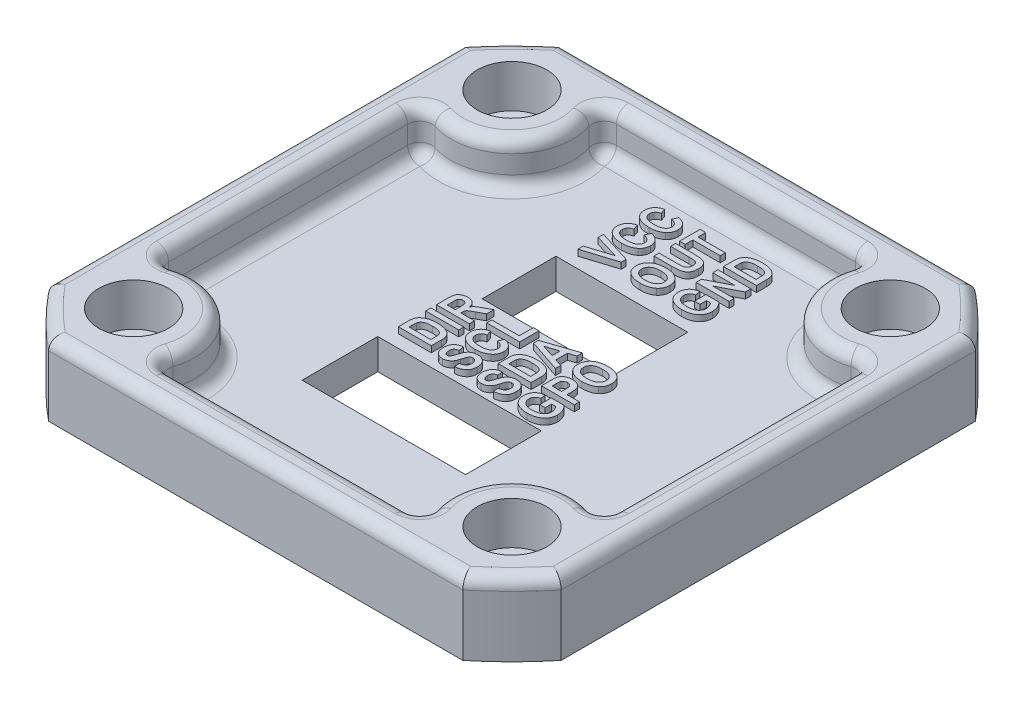
from build123d import *

# Parameters (mm, degrees)
SKETCH2_R           = 2.850000001
SKETCH2_R_2         = 2.849999995
BOSS_EXTRUDE1_DEPTH = 6
SKETCH2_3_R         = 2.850000001
SKETCH2_3_R_2       = 1.6
SKETCH2_3_R_3       = 2.849999995
SKETCH2_3_W         = 13.4
SKETCH2_3_H         = 6.2
SKETCH2_3_W_2       = 10.8
SKETCH2_3_H_2       = 6.05
BOSS_EXTRUDE2_DEPTH = 2.5
FILLET2_R           = 1
SKETCH3_W           = 2.7
SKETCH3_H           = 0.42077922
BOSS_EXTRUDE3_DEPTH = 0.5


with BuildPart() as part:
    # Sketch2 → Boss-Extrude1 (new body)
    with BuildSketch(Plane(origin=(0, 0, 0), x_dir=(1, 0, 0), z_dir=(0, 1, 0))):
        with BuildLine():
            Line((-20.999804574, 16.970804574), (-20.999804574, -16.971195426))
            ThreePointArc((-20.999804574, -16.971195426), (-19.091883092, -19.092273945), (-16.970804574, -21.000195426))
            Line((-16.970804574, -21.000195426), (16.971195426, -21.000195426))
            ThreePointArc((16.971195426, -21.000195426), (19.092273945, -19.092273945), (21.000195426, -16.971195426))
            Line((21.000195426, -16.971195426), (21.000195426, 16.970804574))
            ThreePointArc((21.000195426, 16.970804574), (19.092273945, 19.091883092), (16.971195426, 20.999804574))
            Line((16.971195426, 20.999804574), (-16.970804574, 20.999804574))
            ThreePointArc((-16.970804574, 20.999804574), (-19.091883092, 19.091883092), (-20.999804574, 16.970804574))
        make_face()
        with Locations(Location((15.500195426, -15.500195426, 0), (0, 0, 270))):
            Circle(SKETCH2_R, mode=Mode.SUBTRACT)
        with Locations(Location((-15.499804574, -15.500195426, 0), (0, 0, 270))):
            Circle(SKETCH2_R_2, mode=Mode.SUBTRACT)
        with Locations(Location((15.500195426, 15.499804574, 0), (0, 0, 270))):
            Circle(SKETCH2_R, mode=Mode.SUBTRACT)
        with Locations(Location((-15.499804574, 15.499804574, 0), (0, 0, 270))):
            Circle(SKETCH2_R, mode=Mode.SUBTRACT)
        with BuildLine():
            Line((-11.391581113, -18.350195426), (11.391971966, -18.350195426))
            ThreePointArc((11.391971966, -18.350195426), (11.964661521, -11.964661521), (18.350195426, -11.391971966))
            Line((18.350195426, -11.391971966), (18.350195426, 11.391581113))
            ThreePointArc((18.350195426, 11.391581113), (11.964661521, 11.964270668), (11.391971966, 18.349804574))
            Line((11.391971966, 18.349804574), (-11.391581113, 18.349804574))
            ThreePointArc((-11.391581113, 18.349804574), (-11.964270668, 11.964270668), (-18.349804574, 11.391581113))
            Line((-18.349804574, 11.391581113), (-18.349804574, -11.391971966))
            ThreePointArc((-18.349804574, -11.391971966), (-11.964270668, -11.964661521), (-11.391581113, -18.350195426))
        make_face(mode=Mode.SUBTRACT)
    extrude(amount=BOSS_EXTRUDE1_DEPTH)

    # Sketch2<3> → Boss-Extrude2 (add)
    # profile 1 of 5: a face of its own
    with BuildSketch(Plane(origin=(0, 0, 0), x_dir=(1, 0, 0), z_dir=(0, 1, 0))):
        with Locations(Location((-15.499804574, 15.499804574, 0), (0, 0, 270))):
            Circle(SKETCH2_3_R)
        with Locations(Location((-15.499804574, 15.499804574, 0), (0, 0, 270))):
            Circle(SKETCH2_3_R_2, mode=Mode.SUBTRACT)
    # profile 2 of 5: a face of its own
    with BuildSketch(Plane(origin=(0, 0, 0), x_dir=(1, 0, 0), z_dir=(0, 1, 0))):
        with Locations(Location((15.500195426, 15.499804574, 0), (0, 0, 270))):
            Circle(SKETCH2_3_R)
        with Locations(Location((15.500195426, 15.499804574, 0), (0, 0, 270))):
            Circle(SKETCH2_3_R_2, mode=Mode.SUBTRACT)
    # profile 3 of 5: a face of its own
    with BuildSketch(Plane(origin=(0, 0, 0), x_dir=(1, 0, 0), z_dir=(0, 1, 0))):
        with Locations(Location((15.500195426, -15.500195426, 0), (0, 0, 270))):
            Circle(SKETCH2_3_R)
        with Locations(Location((15.500195426, -15.500195426, 0), (0, 0, 270))):
            Circle(SKETCH2_3_R_2, mode=Mode.SUBTRACT)
    # profile 4 of 5: a face of its own
    with BuildSketch(Plane(origin=(0, 0, 0), x_dir=(1, 0, 0), z_dir=(0, 1, 0))):
        with Locations(Location((-15.499804574, -15.500195426, 0), (0, 0, 270))):
            Circle(SKETCH2_3_R_3)
        with Locations(Location((-15.499804574, -15.500195426, 0), (0, 0, 270))):
            Circle(SKETCH2_3_R_2, mode=Mode.SUBTRACT)
    # profile 5 of 5: a face of its own
    with BuildSketch(Plane(origin=(0, 0, 0), x_dir=(1, 0, 0), z_dir=(0, 1, 0))):
        with BuildLine():
            ThreePointArc((-11.391581113, -18.350195426), (-11.964270668, -11.964661521), (-18.349804574, -11.391971966))
            Line((-18.349804574, -11.391971966), (-18.349804574, 11.391581113))
            ThreePointArc((-18.349804574, 11.391581113), (-11.964270668, 11.964270668), (-11.391581113, 18.349804574))
            Line((-11.391581113, 18.349804574), (11.391971966, 18.349804574))
            ThreePointArc((11.391971966, 18.349804574), (11.964661521, 11.964270668), (18.350195426, 11.391581113))
            Line((18.350195426, 11.391581113), (18.350195426, -11.391971966))
            ThreePointArc((18.350195426, -11.391971966), (11.964661521, -11.964661521), (11.391971966, -18.350195426))
            Line((11.391971966, -18.350195426), (-11.391581113, -18.350195426))
        make_face()
        with Locations((-0.299804574, -7.100195426)):
            Rectangle(SKETCH2_3_W, SKETCH2_3_H, mode=Mode.SUBTRACT)
        with Locations((0.000195426, 5.974804574)):
            Rectangle(SKETCH2_3_W_2, SKETCH2_3_H_2, mode=Mode.SUBTRACT)
    extrude(amount=BOSS_EXTRUDE2_DEPTH)

    # Fillet2
    fillet2_edges = [part.edges().sort_by_distance(p)[0] for p in [
        (18.350195426, 6, 0.000195426),
        (11.964661521, 6, 11.964661521),
        (-20.999804574, 6, 0.000195426),
        (-19.091883092, 6, 19.092273945),
        (0.000195426, 6, 21.000195426),
        (19.092273945, 6, 19.092273945),
        (21.000195426, 6, 0.000195426),
        (19.092273945, 6, -19.091883092),
        (11.391971966, 4.25, 18.350195426),
        (18.350195426, 4.25, 11.391971966),
        (18.350195426, 4.25, -11.391581113),
        (11.391971966, 4.25, -18.349804574),
        (-11.391581113, 4.25, -18.349804574),
        (-18.349804574, 4.25, -11.391581113),
        (-18.349804574, 4.25, 11.391971966),
        (-11.391581113, 4.25, 18.350195426),
        (0.000195426, 6, -20.999804574),
        (-19.091883092, 6, -19.091883092),
        (0.000195426, 6, 18.350195426),
        (-11.964270668, 6, 11.964661521),
        (-18.349804574, 6, 0.000195426),
        (-11.964270668, 6, -11.964270668),
        (0.000195426, 6, -18.349804574),
        (-11.964270668, 2.5, 11.964661521),
        (11.964661521, 2.5, 11.964661521),
        (11.964661521, 2.5, -11.964270668),
        (11.964661521, 6, -11.964270668),
        (-11.964270668, 2.5, -11.964270668),
        (0.000195426, 2.5, 18.350195426),
        (18.350195426, 2.5, 0.000195426),
        (0.000195426, 2.5, -18.349804574),
        (-18.349804574, 2.5, 0.000195426),
    ]]
    fillet(fillet2_edges, radius=FILLET2_R)

    # Sketch3 → Boss-Extrude3 (add)
    # profile 1 of 21: a face of its own
    with BuildSketch(Plane(origin=(0, 2.5, 0), x_dir=(1, 0, 0), z_dir=(0, 1, 0))):
        with BuildLine():
            Line((-6.349804574, -2.962208413), (-6.349804574, -2.145305004))
            add(Edge.make_bspline(
                [(-6.349804574, -2.145305004), (-6.349612133, -2.120280411), (-6.349239716, -2.071851998), (-6.345874695, -2.001500865), (-6.34062396, -1.9358604), (-6.332737729, -1.87505626), (-6.324009917, -1.818913703), (-6.311484618, -1.767881622), (-6.298420555, -1.72106453), (-6.27597441, -1.665123134), (-6.241144815, -1.599271008), (-6.188874805, -1.524231499), (-6.123613786, -1.453353385), (-6.047476558, -1.385302255), (-5.959034525, -1.322192115), (-5.858130046, -1.266211017), (-5.744878351, -1.218545258), (-5.642784287, -1.183924685), (-5.554427929, -1.161126958), (-5.482966039, -1.145745431), (-5.407457123, -1.13275907), (-5.327998051, -1.121717522), (-5.24465106, -1.113504467), (-5.157455431, -1.108483849), (-5.066323977, -1.104151083), (-5.004193509, -1.10389689), (-4.972410093, -1.103766855)],
                knots=[0, 0, 0, 0, 0.908169148, 1.757518736, 2.55566761, 3.297233987, 3.982642805, 4.61608448, 5.20335031, 5.744924636, 6.800401795, 7.899994904, 9.054341188, 10.288996892, 11.600422319, 12.989087469, 14.467785046, 16.054489945, 16.896905739, 17.778340466, 18.70677098, 19.676968856, 20.689359133, 21.74533567, 22.846605597, 24, 24, 24, 24], degree=3))
            add(Edge.make_bspline(
                [(-4.972410093, -1.103766855), (-4.91594482, -1.104660181), (-4.806643359, -1.106389419), (-4.64820737, -1.12117201), (-4.501294686, -1.146083668), (-4.366166713, -1.180571724), (-4.243610475, -1.222700419), (-4.133835887, -1.269939142), (-4.037203173, -1.322463219), (-3.954067267, -1.38159726), (-3.882496649, -1.446796169), (-3.819805946, -1.516994997), (-3.76750967, -1.594556986), (-3.724041494, -1.678990874), (-3.690132595, -1.772988909), (-3.66647479, -1.87839944), (-3.652461903, -1.996084786), (-3.650716872, -2.078604565), (-3.649804574, -2.121745751)],
                knots=[0, 0, 0, 0, 1.423906816, 2.756297612, 4.00880033, 5.178483674, 6.269521323, 7.274139344, 8.18950269, 9.03819926, 9.840385409, 10.626852546, 11.406165152, 12.193104249, 13.016370666, 13.91918964, 14.912156228, 16, 16, 16, 16], degree=3))
            Line((-3.649804574, -2.121745751), (-3.649804574, -2.962208413))
            Line((-3.649804574, -2.962208413), (-6.349804574, -2.962208413))
        make_face()
        with BuildLine():
            Line((-5.893960418, -2.541429193), (-4.105648729, -2.541429193))
            Line((-4.105648729, -2.541429193), (-4.105648729, -2.182013608))
            add(Edge.make_bspline(
                [(-4.105648729, -2.182013608), (-4.105669663, -2.163381169), (-4.105709904, -2.127562945), (-4.108366648, -2.075711893), (-4.110637506, -2.027799757), (-4.114940514, -1.983899299), (-4.121147289, -1.944099084), (-4.128010841, -1.908206269), (-4.136237037, -1.876181829), (-4.148360935, -1.839173047), (-4.168191483, -1.797957321), (-4.195896331, -1.75245358), (-4.229734155, -1.712283413), (-4.269237869, -1.675999202), (-4.317373634, -1.643386371), (-4.376645293, -1.614668887), (-4.447899202, -1.589408742), (-4.530950531, -1.566427314), (-4.626809074, -1.547190176), (-4.73651008, -1.534010022), (-4.860152475, -1.525910217), (-4.947375925, -1.525016113), (-4.993229898, -1.524546076)],
                knots=[0, 0, 0, 0, 0.858555708, 1.650451691, 2.39232543, 3.069028445, 3.682070307, 4.248253181, 4.75248955, 5.204966394, 6.040904205, 6.853682051, 7.654385551, 8.452696638, 9.318810345, 10.323835062, 11.479423305, 12.798608661, 14.292467661, 15.980578125, 17.886961987, 20, 20, 20, 20], degree=3))
            add(Edge.make_bspline(
                [(-4.993229898, -1.524546076), (-5.01752206, -1.524590076), (-5.064838792, -1.524675782), (-5.133877912, -1.527104485), (-5.199113853, -1.530154596), (-5.260338193, -1.534997982), (-5.31749874, -1.541678286), (-5.370666594, -1.549320491), (-5.420101087, -1.55784732), (-5.479453265, -1.571538248), (-5.54721627, -1.591685845), (-5.620360618, -1.623983678), (-5.684997531, -1.661250526), (-5.739917146, -1.705749973), (-5.785954176, -1.755375599), (-5.823074875, -1.810493437), (-5.852278407, -1.87055767), (-5.863953524, -1.913674958), (-5.869853275, -1.935463284)],
                knots=[0, 0, 0, 0, 1.108289637, 2.158747495, 3.151606656, 4.087885153, 4.960242922, 5.776896823, 6.538604919, 7.248114655, 8.555483399, 9.756905758, 10.888752281, 11.949373392, 12.969550763, 13.965656566, 14.971991555, 16, 16, 16, 16], degree=3))
            add(Edge.make_bspline(
                [(-5.869853275, -1.935463284), (-5.871777095, -1.944760296), (-5.876020028, -1.965264608), (-5.880646576, -1.999315581), (-5.885144475, -2.039118579), (-5.888120129, -2.084833322), (-5.891058769, -2.136324894), (-5.892410547, -2.193879874), (-5.893574073, -2.257252483), (-5.893828142, -2.301452807), (-5.893960418, -2.324464907)],
                knots=[0, 0, 0, 0, 0.583558982, 1.287023661, 2.111612924, 3.046011902, 4.102984757, 5.282460342, 6.58516209, 8, 8, 8, 8], degree=3))
            Line((-5.893960418, -2.324464907), (-5.893960418, -2.541429193))
        make_face(mode=Mode.SUBTRACT)
    # profile 2 of 21: a face of its own
    with BuildSketch(Plane(origin=(0, 2.5, 0), x_dir=(1, 0, 0), z_dir=(0, 1, 0))):
        with Locations((-4.999804574, -0.507662959)):
            Rectangle(SKETCH3_W, SKETCH3_H)
    # profile 3 of 21: a face of its own
    with BuildSketch(Plane(origin=(0, 2.5, 0), x_dir=(1, 0, 0), z_dir=(0, 1, 0))):
        with BuildLine():
            Line((-3.649804574, 0.158570807), (-6.349804574, 0.158570807))
            Line((-6.349804574, 0.158570807), (-6.349804574, 1.106419833))
            add(Edge.make_bspline(
                [(-6.349804574, 1.106419833), (-6.349590804, 1.135642303), (-6.349179151, 1.191915649), (-6.346146864, 1.273262098), (-6.339868133, 1.34795245), (-6.332638613, 1.416409084), (-6.322299275, 1.478047054), (-6.309724443, 1.533315854), (-6.295208962, 1.582141343), (-6.272635615, 1.63877058), (-6.235282426, 1.702222323), (-6.178001417, 1.770455573), (-6.107044676, 1.83116243), (-6.024050309, 1.884430873), (-5.929740746, 1.928556326), (-5.825337831, 1.95910349), (-5.712463148, 1.979154468), (-5.634169997, 1.980995957), (-5.593716911, 1.981947431)],
                knots=[0, 0, 0, 0, 1.046899319, 2.016000939, 2.91522307, 3.731661062, 4.481353915, 5.152697079, 5.761194948, 6.304270959, 7.333292633, 8.382927881, 9.482183654, 10.665437712, 11.906534715, 13.198099546, 14.552293305, 16, 16, 16, 16], degree=3))
            add(Edge.make_bspline(
                [(-5.593716911, 1.981947431), (-5.567951232, 1.981346316), (-5.517599511, 1.980171608), (-5.443927787, 1.973198597), (-5.374028916, 1.960767116), (-5.308244192, 1.942339086), (-5.245897224, 1.920374384), (-5.187997842, 1.891865632), (-5.133560017, 1.859095937), (-5.083101204, 1.821248129), (-5.036868039, 1.778681094), (-4.994490696, 1.732212338), (-4.956997288, 1.680968243), (-4.924962595, 1.625139363), (-4.895981758, 1.565918327), (-4.872727939, 1.501899656), (-4.853285532, 1.433806217), (-4.844375398, 1.386477361), (-4.839820807, 1.362284281)],
                knots=[0, 0, 0, 0, 1.148860668, 2.24512269, 3.29608415, 4.309498504, 5.288333042, 6.23884931, 7.181485186, 8.117910622, 9.045800289, 9.979708686, 10.917831956, 11.870299432, 12.846352702, 13.853729696, 14.902891537, 16, 16, 16, 16], degree=3))
            add(Edge.make_bspline(
                [(-4.839820807, 1.362284281), (-4.822802783, 1.386277691), (-4.789504818, 1.433223902), (-4.734986405, 1.497950628), (-4.678478316, 1.55644237), (-4.627943378, 1.600753476), (-4.582858547, 1.6343553), (-4.543509986, 1.662288331), (-4.497857125, 1.692480706), (-4.445832863, 1.724586206), (-4.387736517, 1.759088168), (-4.323600912, 1.795757232), (-4.253218976, 1.834725997), (-4.204110558, 1.861273769), (-4.178518048, 1.875108957)],
                knots=[0, 0, 0, 0, 1.249887608, 2.445566852, 3.592894883, 4.704341249, 5.297411891, 5.982333531, 6.755256186, 7.623358256, 8.580562889, 9.627172285, 10.763417311, 12, 12, 12, 12], degree=3))
            Line((-4.178518048, 1.875108957), (-3.649804574, 2.157272106))
            Line((-3.649804574, 2.157272106), (-3.649804574, 1.566099216))
            Line((-3.649804574, 1.566099216), (-4.233854898, 1.253254249))
            add(Edge.make_bspline(
                [(-4.233854898, 1.253254249), (-4.259085289, 1.239790754), (-4.307102237, 1.214167847), (-4.375179121, 1.176820927), (-4.435712577, 1.142859299), (-4.489366637, 1.112911011), (-4.535011707, 1.085240087), (-4.57427398, 1.06217154), (-4.605264704, 1.041298988), (-4.636479873, 1.019159658), (-4.66742137, 0.992748164), (-4.698535054, 0.960418568), (-4.723273695, 0.926847495), (-4.74341583, 0.891351354), (-4.756731373, 0.849278013), (-4.765219714, 0.7987985), (-4.771511341, 0.738024599), (-4.771752273, 0.694061593), (-4.771882496, 0.670299703)],
                knots=[0, 0, 0, 0, 1.601116404, 3.047147631, 4.347169113, 5.487335164, 6.486876466, 7.335611805, 8.036079242, 8.578099894, 9.477549916, 10.309300743, 11.084378876, 11.80739449, 12.58341628, 13.540039984, 14.670398072, 16, 16, 16, 16], degree=3))
            Line((-4.771882496, 0.670299703), (-4.771882496, 0.579350028))
            Line((-4.771882496, 0.579350028), (-3.649804574, 0.579350028))
            Line((-3.649804574, 0.579350028), (-3.649804574, 0.158570807))
        make_face()
        with BuildLine():
            Line((-5.227726651, 0.579350028), (-5.227726651, 0.939313502))
            add(Edge.make_bspline(
                [(-5.227726651, 0.939313502), (-5.22788313, 0.965611944), (-5.228180886, 1.015654273), (-5.229009174, 1.086897544), (-5.231436056, 1.150626648), (-5.233752167, 1.20674323), (-5.237877807, 1.255482485), (-5.241731327, 1.296689512), (-5.247316532, 1.330486709), (-5.254890793, 1.365431643), (-5.269140873, 1.402237657), (-5.291953049, 1.441727633), (-5.322016675, 1.476448605), (-5.358418219, 1.506647389), (-5.401183284, 1.532016227), (-5.451135276, 1.5490594), (-5.50742738, 1.559716407), (-5.547092544, 1.560667633), (-5.5679661, 1.56116821)],
                knots=[0, 0, 0, 0, 1.530815797, 2.912932493, 4.146792843, 5.243014302, 6.181445224, 6.993819934, 7.65093056, 8.174417489, 9.072734219, 9.93510874, 10.81717649, 11.730464117, 12.67853927, 13.693952014, 14.786456057, 16, 16, 16, 16], degree=3))
            add(Edge.make_bspline(
                [(-5.5679661, 1.56116821), (-5.587927564, 1.560662531), (-5.625963109, 1.559698985), (-5.680086075, 1.549014151), (-5.728330174, 1.531853607), (-5.770087066, 1.506683423), (-5.805265093, 1.475681097), (-5.835104925, 1.439808537), (-5.858902635, 1.398714134), (-5.869083499, 1.368342372), (-5.874236392, 1.352970158)],
                knots=[0, 0, 0, 0, 1.194102546, 2.275301051, 3.289283787, 4.246012641, 5.176236263, 6.085186267, 7.030845575, 8, 8, 8, 8], degree=3))
            add(Edge.make_bspline(
                [(-5.874236392, 1.352970158), (-5.875767208, 1.346044016), (-5.879410978, 1.32955786), (-5.883683845, 1.300488703), (-5.886601759, 1.263149816), (-5.889331723, 1.217848798), (-5.891405434, 1.164508567), (-5.893206051, 1.103144186), (-5.893351224, 1.033731916), (-5.893750403, 0.984787869), (-5.893960418, 0.959037528)],
                knots=[0, 0, 0, 0, 0.430892152, 1.025643899, 1.783105936, 2.70574662, 3.782977, 5.026178935, 6.435419374, 8, 8, 8, 8], degree=3))
            Line((-5.893960418, 0.959037528), (-5.893960418, 0.579350028))
            Line((-5.893960418, 0.579350028), (-5.227726651, 0.579350028))
        make_face(mode=Mode.SUBTRACT)
    # profile 4 of 21: a face of its own
    with BuildSketch(Plane(origin=(0, 2.5, 0), x_dir=(1, 0, 0), z_dir=(0, 1, 0))):
        with BuildLine():
            Line((-1.211492885, -3.488182439), (-1.24655782, -3.067403219))
            add(Edge.make_bspline(
                [(-1.24655782, -3.067403219), (-1.225322594, -3.064009106), (-1.183913129, -3.057390463), (-1.1243812, -3.043443214), (-1.068508468, -3.02794526), (-1.01725436, -3.00854321), (-0.969494739, -2.987405011), (-0.926443067, -2.962622203), (-0.886869811, -2.935742957), (-0.851963499, -2.905595924), (-0.820909088, -2.872961081), (-0.793811676, -2.837858785), (-0.771356312, -2.799625509), (-0.752475324, -2.758985591), (-0.738421764, -2.715309685), (-0.727865949, -2.669145706), (-0.721926835, -2.620113947), (-0.721038577, -2.586554023), (-0.720583794, -2.569371563)],
                knots=[0, 0, 0, 0, 1.283284002, 2.502450598, 3.648036641, 4.741550817, 5.771019705, 6.762197452, 7.702675527, 8.622646947, 9.509464764, 10.388204522, 11.263216913, 12.15103932, 13.057737472, 13.996634539, 14.974290105, 16, 16, 16, 16], degree=3))
            add(Edge.make_bspline(
                [(-0.720583794, -2.569371563), (-0.720881383, -2.552373741), (-0.721461882, -2.519216467), (-0.72647855, -2.471051709), (-0.734506808, -2.425508343), (-0.746714615, -2.383107459), (-0.76139794, -2.342909493), (-0.780100967, -2.305999447), (-0.80149493, -2.271356913), (-0.826756546, -2.240469414), (-0.854210217, -2.212575586), (-0.882969788, -2.187586905), (-0.914107683, -2.167526783), (-0.946074928, -2.149979135), (-0.980049616, -2.137010829), (-1.015700356, -2.127717933), (-1.052738499, -2.121291995), (-1.078145673, -2.120865188), (-1.090957171, -2.120649972)],
                knots=[0, 0, 0, 0, 1.250220802, 2.438778044, 3.558832365, 4.647748673, 5.680942658, 6.702450839, 7.686604229, 8.670757619, 9.630391542, 10.564573021, 11.466404369, 12.350035455, 13.243318445, 14.133057652, 15.058599454, 16, 16, 16, 16], degree=3))
            add(Edge.make_bspline(
                [(-1.090957171, -2.120649972), (-1.10578606, -2.121154149), (-1.134590716, -2.122133498), (-1.176272838, -2.130365719), (-1.214460759, -2.144838046), (-1.249429589, -2.16457388), (-1.280495395, -2.190541575), (-1.3089792, -2.221681253), (-1.333851171, -2.25926479), (-1.352619105, -2.295380157), (-1.367761123, -2.32978485), (-1.379916188, -2.363535543), (-1.395076041, -2.403821083), (-1.410513562, -2.451776015), (-1.428691305, -2.506285942), (-1.448680916, -2.567881697), (-1.46907009, -2.63697945), (-1.483759097, -2.685352266), (-1.491464476, -2.710727082)],
                knots=[0, 0, 0, 0, 0.920775054, 1.78857699, 2.625185636, 3.448454838, 4.270707031, 5.130086763, 6.061564823, 7.061365466, 7.655813446, 8.395481985, 9.289226881, 10.329723515, 11.524506071, 12.859289256, 14.352484594, 16, 16, 16, 16], degree=3))
            add(Edge.make_bspline(
                [(-1.491464476, -2.710727082), (-1.498444281, -2.733783606), (-1.511967368, -2.77845468), (-1.533993398, -2.842742655), (-1.556345752, -2.902092428), (-1.578643637, -2.956987283), (-1.602543829, -3.006555531), (-1.625397016, -3.052324063), (-1.650543821, -3.092290539), (-1.683085959, -3.139947294), (-1.728641221, -3.193220554), (-1.791191215, -3.249308927), (-1.861373867, -3.299047079), (-1.938718104, -3.34112258), (-2.021068454, -3.376096073), (-2.107907412, -3.399803584), (-2.197502329, -3.415332522), (-2.258444644, -3.41714043), (-2.289191749, -3.418052569)],
                knots=[0, 0, 0, 0, 0.9958258, 1.929371821, 2.808613085, 3.617625084, 4.377515408, 5.083267562, 5.7307202, 6.327599064, 7.468346854, 8.617657217, 9.792863046, 11.016054113, 12.251348242, 13.482366585, 14.729783437, 16, 16, 16, 16], degree=3))
            add(Edge.make_bspline(
                [(-2.289191749, -3.418052569), (-2.324714764, -3.416810844), (-2.394468404, -3.414372571), (-2.496323369, -3.394462241), (-2.592837689, -3.362868612), (-2.682899179, -3.318201002), (-2.765139943, -3.262751573), (-2.837016997, -3.196143511), (-2.898691084, -3.120383323), (-2.948914419, -3.034236047), (-2.98805604, -2.937965492), (-3.014707092, -2.831142776), (-3.032259936, -2.714409855), (-3.033977847, -2.632996098), (-3.034869509, -2.590739258)],
                knots=[0, 0, 0, 0, 1.015835736, 1.994713566, 2.958235717, 3.914187545, 4.862206145, 5.786829117, 6.708345097, 7.647709513, 8.62987442, 9.671845376, 10.791599075, 12, 12, 12, 12], degree=3))
            add(Edge.make_bspline(
                [(-3.034869509, -2.590739258), (-3.03426056, -2.558572008), (-3.033070793, -2.495723464), (-3.023182388, -2.404265785), (-3.006662715, -2.318384698), (-2.984491841, -2.23763952), (-2.954789842, -2.162686174), (-2.919036424, -2.092675836), (-2.87622392, -2.028653145), (-2.827084673, -1.969931184), (-2.771742624, -1.917635088), (-2.711181119, -1.870853147), (-2.644033091, -1.83201708), (-2.571725131, -1.799186053), (-2.493746218, -1.772690224), (-2.410236849, -1.753256797), (-2.321174465, -1.739885426), (-2.259834906, -1.73661366), (-2.228376002, -1.734935686)],
                knots=[0, 0, 0, 0, 1.160947592, 2.268265598, 3.315533968, 4.315265338, 5.286060137, 6.220726383, 7.147735512, 8.060190557, 8.978816683, 9.891247914, 10.816121425, 11.772005885, 12.753928911, 13.783704614, 14.863340009, 16, 16, 16, 16], degree=3))
            Line((-2.228376002, -1.734935686), (-2.193311067, -2.155714907))
            add(Edge.make_bspline(
                [(-2.193311067, -2.155714907), (-2.21050377, -2.158675692), (-2.243763282, -2.164403369), (-2.291691928, -2.175077597), (-2.335413051, -2.188811127), (-2.375371232, -2.204552021), (-2.410771333, -2.223261198), (-2.442696449, -2.24351364), (-2.470150986, -2.266705655), (-2.502033495, -2.300598549), (-2.533796035, -2.351433925), (-2.560507978, -2.42213826), (-2.576183424, -2.503862928), (-2.578043889, -2.561812415), (-2.579025353, -2.592382926)],
                knots=[0, 0, 0, 0, 0.959243267, 1.855668837, 2.69732651, 3.476781153, 4.213401683, 4.895802106, 5.551525866, 6.183841498, 7.448472762, 8.815414589, 10.320012641, 12, 12, 12, 12], degree=3))
            add(Edge.make_bspline(
                [(-2.579025353, -2.592382926), (-2.578429765, -2.622962242), (-2.577302389, -2.680845154), (-2.56247404, -2.761912335), (-2.541184772, -2.832950667), (-2.508340089, -2.891429943), (-2.46959381, -2.938466917), (-2.424954353, -2.972232094), (-2.375370213, -2.993759927), (-2.340357272, -2.996091651), (-2.322613015, -2.997273349)],
                knots=[0, 0, 0, 0, 1.375879949, 2.604372843, 3.702615451, 4.700949709, 5.606067643, 6.429004151, 7.203832851, 8, 8, 8, 8], degree=3))
            add(Edge.make_bspline(
                [(-2.322613015, -2.997273349), (-2.305307846, -2.996059114), (-2.271115032, -2.993659941), (-2.222109678, -2.976049465), (-2.178033021, -2.945860613), (-2.154216665, -2.918785097), (-2.141809444, -2.904680004)],
                knots=[0, 0, 0, 0, 0.986221752, 1.948648769, 2.931340805, 4, 4, 4, 4], degree=3))
            add(Edge.make_bspline(
                [(-2.141809444, -2.904680004), (-2.135395201, -2.896045204), (-2.121217264, -2.876958983), (-2.102930137, -2.842575316), (-2.082200649, -2.802209234), (-2.062491861, -2.754063291), (-2.040903014, -2.699664078), (-2.019793272, -2.637678941), (-1.997310836, -2.569066158), (-1.982809454, -2.520644789), (-1.975251002, -2.495406465)],
                knots=[0, 0, 0, 0, 0.580970997, 1.284168869, 2.101321398, 3.035084219, 4.095219995, 5.266568887, 6.575273271, 8, 8, 8, 8], degree=3))
            add(Edge.make_bspline(
                [(-1.975251002, -2.495406465), (-1.967054712, -2.468309938), (-1.951198701, -2.415890758), (-1.92486599, -2.340952089), (-1.900437726, -2.271023784), (-1.873679102, -2.207826955), (-1.848242344, -2.149766503), (-1.821824346, -2.09779276), (-1.795796643, -2.051173481), (-1.760988362, -1.99715811), (-1.712594438, -1.937868335), (-1.648081083, -1.874425792), (-1.574002819, -1.822112092), (-1.49353331, -1.776664301), (-1.403517736, -1.74240933), (-1.30523931, -1.717273392), (-1.197878116, -1.702451186), (-1.123512679, -1.700752213), (-1.084930385, -1.699870751)],
                knots=[0, 0, 0, 0, 1.03573084, 2.003657489, 2.906334414, 3.745289117, 4.514076012, 5.225381558, 5.877736671, 6.467191059, 7.574546256, 8.671019237, 9.767186695, 10.882979159, 12.044581108, 13.279675832, 14.588640752, 16, 16, 16, 16], degree=3))
            add(Edge.make_bspline(
                [(-1.084930385, -1.699870751), (-1.056584317, -1.700411829), (-1.000789358, -1.70147686), (-0.918954156, -1.712584381), (-0.840302921, -1.728474726), (-0.765204, -1.752223193), (-0.693955768, -1.783291694), (-0.625434982, -1.819736286), (-0.561251681, -1.8642182), (-0.500199424, -1.914237949), (-0.444448179, -1.971882678), (-0.396089443, -2.037498324), (-0.355202908, -2.110802944), (-0.321910241, -2.191561259), (-0.296329571, -2.279987331), (-0.277776598, -2.375682536), (-0.266914239, -2.479084794), (-0.265480462, -2.550534381), (-0.264739638, -2.58745192)],
                knots=[0, 0, 0, 0, 0.991997585, 1.95259757, 2.887018476, 3.799202844, 4.704433576, 5.605793122, 6.512220339, 7.434215821, 8.365941055, 9.312451492, 10.280220075, 11.298040995, 12.364505644, 13.498314346, 14.707395227, 16, 16, 16, 16], degree=3))
            add(Edge.make_bspline(
                [(-0.264739638, -2.58745192), (-0.265485969, -2.620354453), (-0.266937377, -2.684340881), (-0.2779013, -2.777541489), (-0.296609856, -2.864970445), (-0.32198857, -2.947095219), (-0.355987314, -3.023259112), (-0.39627615, -3.094406591), (-0.444905249, -3.159348754), (-0.50092973, -3.218559033), (-0.564196409, -3.272249596), (-0.634685308, -3.320875931), (-0.713042649, -3.362756332), (-0.79831311, -3.399818686), (-0.891362805, -3.429898846), (-0.991317209, -3.455960639), (-1.098865316, -3.47549071), (-1.173264716, -3.483874599), (-1.211492885, -3.488182439)],
                knots=[0, 0, 0, 0, 1.077126704, 2.094716892, 3.06695406, 4.001175917, 4.903369973, 5.792630967, 6.672819179, 7.55264172, 8.45610307, 9.384912885, 10.350803934, 11.360510561, 12.42508299, 13.549057315, 14.740647766, 16, 16, 16, 16], degree=3))
        make_face()
    # profile 5 of 21: a face of its own
    with BuildSketch(Plane(origin=(0, 2.5, 0), x_dir=(1, 0, 0), z_dir=(0, 1, 0))):
        with BuildLine():
            Line((-1.281622755, 0.088440937), (-1.10629808, 0.509220158))
            add(Edge.make_bspline(
                [(-1.10629808, 0.509220158), (-1.070928139, 0.500529126), (-1.002008063, 0.483594221), (-0.903494795, 0.451568658), (-0.81211559, 0.41628134), (-0.728406301, 0.376142671), (-0.651886397, 0.331783596), (-0.582703923, 0.283069477), (-0.520744361, 0.230185781), (-0.46621746, 0.173064588), (-0.419236612, 0.111806318), (-0.377578219, 0.047900747), (-0.342510749, -0.019608898), (-0.313734683, -0.090752265), (-0.292164604, -0.165385375), (-0.275988529, -0.243186319), (-0.266719045, -0.324442987), (-0.265406864, -0.379799215), (-0.264739638, -0.40794705)],
                knots=[0, 0, 0, 0, 1.282795787, 2.499590921, 3.646629963, 4.73157007, 5.766696357, 6.759253517, 7.708379509, 8.632241621, 9.535713916, 10.424495377, 11.31662425, 12.21153307, 13.123647302, 14.049858988, 15.008381744, 16, 16, 16, 16], degree=3))
            add(Edge.make_bspline(
                [(-0.264739638, -0.40794705), (-0.265533646, -0.443263824), (-0.267089089, -0.51244855), (-0.283825267, -0.613402361), (-0.309252974, -0.709468608), (-0.34576732, -0.800474127), (-0.39244043, -0.88652683), (-0.450251931, -0.966717647), (-0.517049601, -1.04291776), (-0.569132097, -1.087222877), (-0.595664963, -1.109793641)],
                knots=[0, 0, 0, 0, 1.053414494, 2.063614103, 3.046293227, 4.01520277, 4.983805463, 5.961130836, 6.961320097, 8, 8, 8, 8], degree=3))
            add(Edge.make_bspline(
                [(-0.595664963, -1.109793641), (-0.628423117, -1.134603446), (-0.694417445, -1.184585091), (-0.803241975, -1.247334272), (-0.920155644, -1.300703655), (-1.045264417, -1.344383863), (-1.1787069, -1.378430282), (-1.320546712, -1.40223315), (-1.470715244, -1.416527498), (-1.573615964, -1.418395743), (-1.62624532, -1.419351271)],
                knots=[0, 0, 0, 0, 0.898140554, 1.809387162, 2.740718204, 3.705966939, 4.703925369, 5.74945803, 6.848943185, 8, 8, 8, 8], degree=3))
            add(Edge.make_bspline(
                [(-1.62624532, -1.419351271), (-1.681803046, -1.418478327), (-1.790020174, -1.416777978), (-1.947574024, -1.401468916), (-2.096109807, -1.378130906), (-2.235075439, -1.343334903), (-2.365268872, -1.299745244), (-2.485878237, -1.245890346), (-2.598164923, -1.183359404), (-2.66522632, -1.132341304), (-2.698465288, -1.107054193)],
                knots=[0, 0, 0, 0, 1.171098873, 2.281104103, 3.334483992, 4.338438261, 5.297974877, 6.225356982, 7.120398547, 8, 8, 8, 8], degree=3))
            add(Edge.make_bspline(
                [(-2.698465288, -1.107054193), (-2.72533868, -1.084097224), (-2.778300372, -1.038853964), (-2.846798825, -0.961478582), (-2.905296123, -0.878592974), (-2.952049932, -0.789324314), (-2.990180582, -0.694852839), (-3.016107734, -0.594100175), (-3.031637991, -0.487510396), (-3.033775872, -0.414575306), (-3.034869509, -0.377265232)],
                knots=[0, 0, 0, 0, 1.017529723, 2.005332824, 2.969004906, 3.934328403, 4.902874787, 5.898610158, 6.925030324, 8, 8, 8, 8], degree=3))
            add(Edge.make_bspline(
                [(-3.034869509, -0.377265232), (-3.034138701, -0.346733884), (-3.032702332, -0.286725953), (-3.021219349, -0.198735203), (-3.001028129, -0.11490238), (-2.974543548, -0.034409155), (-2.939107454, 0.042038268), (-2.89610782, 0.114660939), (-2.845686018, 0.183744449), (-2.806487771, 0.225617057), (-2.786675515, 0.246781035)],
                knots=[0, 0, 0, 0, 1.062174293, 2.087653736, 3.080296642, 4.058948008, 5.03139012, 6.005719887, 6.992016441, 8, 8, 8, 8], degree=3))
            add(Edge.make_bspline(
                [(-2.786675515, 0.246781035), (-2.771405852, 0.261496143), (-2.740290574, 0.291481396), (-2.687878831, 0.331856607), (-2.630157454, 0.369237046), (-2.566880114, 0.402952523), (-2.498665276, 0.434296731), (-2.425163277, 0.462798555), (-2.3462069, 0.487872218), (-2.2914558, 0.501994245), (-2.263440937, 0.509220158)],
                knots=[0, 0, 0, 0, 0.858002413, 1.748367619, 2.673305357, 3.63929672, 4.648357542, 5.711115493, 6.828831091, 8, 8, 8, 8], degree=3))
            Line((-2.263440937, 0.509220158), (-2.123181197, 0.088440937))
            add(Edge.make_bspline(
                [(-2.123181197, 0.088440937), (-2.141139508, 0.084486898), (-2.1760834, 0.076792993), (-2.22651219, 0.061345589), (-2.273350514, 0.042538993), (-2.317722793, 0.02207717), (-2.358094259, -0.002562271), (-2.396393884, -0.028335903), (-2.430325866, -0.058557899), (-2.461673199, -0.090486601), (-2.488762491, -0.125248225), (-2.513260529, -0.160829872), (-2.533628852, -0.198292367), (-2.550010104, -0.237479444), (-2.563267489, -0.277926966), (-2.572590407, -0.31993633), (-2.57823605, -0.363411394), (-2.578759635, -0.392954167), (-2.579025353, -0.40794705)],
                knots=[0, 0, 0, 0, 1.200071046, 2.335138942, 3.437621639, 4.493482591, 5.51985659, 6.521917265, 7.50210956, 8.480124453, 9.438987346, 10.374745328, 11.297656865, 12.216555725, 13.143999084, 14.072438006, 15.021767148, 16, 16, 16, 16], degree=3))
            add(Edge.make_bspline(
                [(-2.579025353, -0.40794705), (-2.578396287, -0.429165742), (-2.577158222, -0.470926299), (-2.567306615, -0.532108387), (-2.549885263, -0.589997734), (-2.527002992, -0.645452655), (-2.496560329, -0.697590687), (-2.459608025, -0.746701712), (-2.415745065, -0.792320659), (-2.365685437, -0.835424998), (-2.307703204, -0.874921993), (-2.240398112, -0.907951737), (-2.164572889, -0.935641269), (-2.080577767, -0.959298919), (-1.987816542, -0.977038852), (-1.88639994, -0.98933849), (-1.776484937, -0.997017997), (-1.700223643, -0.998042119), (-1.660762366, -0.99857205)],
                knots=[0, 0, 0, 0, 0.827612453, 1.62882597, 2.408882339, 3.181680995, 3.963817172, 4.757550728, 5.573984975, 6.42795311, 7.331067437, 8.302927392, 9.344503745, 10.47687368, 11.703751173, 13.024965775, 14.460573615, 16, 16, 16, 16], degree=3))
            add(Edge.make_bspline(
                [(-1.660762366, -0.99857205), (-1.619845721, -0.99797317), (-1.541052655, -0.996819908), (-1.427249056, -0.990097322), (-1.322689614, -0.977319281), (-1.226963196, -0.960962418), (-1.140629329, -0.938579583), (-1.063635138, -0.911234628), (-0.995228954, -0.879737589), (-0.936308278, -0.842164999), (-0.885442193, -0.800533826), (-0.841279349, -0.756272276), (-0.804387438, -0.708525829), (-0.773121755, -0.658571829), (-0.74942945, -0.605038837), (-0.733309737, -0.54856017), (-0.722160513, -0.489470783), (-0.721116404, -0.448909614), (-0.720583794, -0.428218965)],
                knots=[0, 0, 0, 0, 1.588381619, 3.058741945, 4.422565575, 5.675514383, 6.825848758, 7.879737597, 8.8437938, 9.742560847, 10.584031071, 11.391113559, 12.163968987, 12.921455088, 13.673648094, 14.427376256, 15.197789283, 16, 16, 16, 16], degree=3))
            add(Edge.make_bspline(
                [(-0.720583794, -0.428218965), (-0.7210745, -0.413049788), (-0.722047921, -0.382958391), (-0.727688597, -0.338535033), (-0.73941944, -0.29611107), (-0.753059972, -0.254569988), (-0.772749645, -0.215236226), (-0.795719785, -0.177075245), (-0.823361316, -0.140797369), (-0.855353425, -0.106224904), (-0.891401353, -0.073272153), (-0.932532117, -0.042836766), (-0.978706492, -0.015067132), (-1.029846174, 0.010637959), (-1.085644607, 0.034155974), (-1.14648657, 0.054904569), (-1.212080938, 0.073676384), (-1.257995659, 0.083424624), (-1.281622755, 0.088440937)],
                knots=[0, 0, 0, 0, 0.874165942, 1.73410025, 2.571011852, 3.406070119, 4.248254488, 5.098026256, 5.969085, 6.86993583, 7.808274097, 8.778218963, 9.812010937, 10.908203772, 12.072687052, 13.296980465, 14.609062556, 16, 16, 16, 16], degree=3))
        make_face()
    # profile 6 of 21: a face of its own
    with BuildSketch(Plane(origin=(0, 2.5, 0), x_dir=(1, 0, 0), z_dir=(0, 1, 0))):
        Polygon((-0.299804574, 0.929999379), (-2.999804574, 0.929999379), (-2.999804574, 1.3507786), (-0.755648729, 1.3507786), (-0.755648729, 2.507921457), (-0.299804574, 2.507921457), align=None)
    # profile 7 of 21: a face of its own
    with BuildSketch(Plane(origin=(0, 2.5, 0), x_dir=(1, 0, 0), z_dir=(0, 1, 0))):
        with BuildLine():
            Line((2.138507115, -3.663507115), (2.10344218, -3.242727894))
            add(Edge.make_bspline(
                [(2.10344218, -3.242727894), (2.124677406, -3.239333782), (2.166086871, -3.232715139), (2.2256188, -3.218767889), (2.281491532, -3.203269935), (2.33274564, -3.183867885), (2.380505261, -3.162729686), (2.423556933, -3.137946878), (2.463130189, -3.111067633), (2.498036501, -3.080920599), (2.529090912, -3.048285756), (2.556188324, -3.01318346), (2.578643688, -2.974950185), (2.597524676, -2.934310266), (2.611578236, -2.89063436), (2.622134051, -2.844470381), (2.628073165, -2.795438623), (2.628961423, -2.761878698), (2.629416206, -2.744696238)],
                knots=[0, 0, 0, 0, 1.283284002, 2.502450598, 3.648036641, 4.741550817, 5.771019705, 6.762197452, 7.702675527, 8.622646947, 9.509464764, 10.388204522, 11.263216913, 12.15103932, 13.057737472, 13.996634539, 14.974290105, 16, 16, 16, 16], degree=3))
            add(Edge.make_bspline(
                [(2.629416206, -2.744696238), (2.629118617, -2.727698417), (2.628538118, -2.694541143), (2.62352145, -2.646376385), (2.615493192, -2.600833018), (2.603285385, -2.558432134), (2.58860206, -2.518234168), (2.569899033, -2.481324122), (2.54850507, -2.446681588), (2.523243454, -2.415794089), (2.495789783, -2.387900261), (2.467030212, -2.36291158), (2.435892317, -2.342851459), (2.403925072, -2.32530381), (2.369950384, -2.312335504), (2.334299644, -2.303042609), (2.297261501, -2.296616671), (2.271854327, -2.296189864), (2.259042829, -2.295974647)],
                knots=[0, 0, 0, 0, 1.250220802, 2.438778044, 3.558832365, 4.647748673, 5.680942658, 6.702450839, 7.686604229, 8.670757619, 9.630391542, 10.564573021, 11.466404369, 12.350035455, 13.243318445, 14.133057652, 15.058599454, 16, 16, 16, 16], degree=3))
            add(Edge.make_bspline(
                [(2.259042829, -2.295974647), (2.24421394, -2.296478825), (2.215409284, -2.297458173), (2.173727162, -2.305690394), (2.135539241, -2.320162721), (2.100570411, -2.339898556), (2.069504605, -2.365866251), (2.0410208, -2.397005929), (2.016148829, -2.434589465), (1.997380895, -2.470704832), (1.982238877, -2.505109525), (1.970083812, -2.538860218), (1.954923959, -2.579145758), (1.939486438, -2.627100691), (1.921308695, -2.681610618), (1.901319084, -2.743206373), (1.88092991, -2.812304125), (1.866240903, -2.860676941), (1.858535524, -2.886051758)],
                knots=[0, 0, 0, 0, 0.920775054, 1.78857699, 2.625185636, 3.448454838, 4.270707031, 5.130086763, 6.061564823, 7.061365466, 7.655813446, 8.395481985, 9.289226881, 10.329723515, 11.524506071, 12.859289256, 14.352484594, 16, 16, 16, 16], degree=3))
            add(Edge.make_bspline(
                [(1.858535524, -2.886051758), (1.851555719, -2.909108282), (1.838032632, -2.953779355), (1.816006602, -3.018067331), (1.793654248, -3.077417104), (1.771356363, -3.132311959), (1.747456171, -3.181880207), (1.724602984, -3.227648738), (1.699456179, -3.267615214), (1.666914041, -3.315271969), (1.621358779, -3.36854523), (1.558808785, -3.424633603), (1.488626133, -3.474371754), (1.411281896, -3.516447256), (1.328931546, -3.551420748), (1.242092588, -3.57512826), (1.152497671, -3.590657198), (1.091555356, -3.592465105), (1.060808251, -3.593377245)],
                knots=[0, 0, 0, 0, 0.9958258, 1.929371821, 2.808613085, 3.617625084, 4.377515408, 5.083267562, 5.7307202, 6.327599064, 7.468346854, 8.617657217, 9.792863046, 11.016054113, 12.251348242, 13.482366585, 14.729783437, 16, 16, 16, 16], degree=3))
            add(Edge.make_bspline(
                [(1.060808251, -3.593377245), (1.025285236, -3.59213552), (0.955531596, -3.589697246), (0.853676631, -3.569786916), (0.757162311, -3.538193288), (0.667100821, -3.493525678), (0.584860057, -3.438076248), (0.512983003, -3.371468186), (0.451308916, -3.295707999), (0.401085581, -3.209560722), (0.36194396, -3.113290168), (0.335292908, -3.006467452), (0.317740064, -2.88973453), (0.316022153, -2.808320773), (0.315130491, -2.766063933)],
                knots=[0, 0, 0, 0, 1.015835736, 1.994713566, 2.958235717, 3.914187545, 4.862206145, 5.786829117, 6.708345097, 7.647709513, 8.62987442, 9.671845376, 10.791599075, 12, 12, 12, 12], degree=3))
            add(Edge.make_bspline(
                [(0.315130491, -2.766063933), (0.31573944, -2.733896683), (0.316929207, -2.671048139), (0.326817612, -2.579590461), (0.343337285, -2.493709373), (0.365508159, -2.412964195), (0.395210158, -2.338010849), (0.430963576, -2.268000512), (0.47377608, -2.20397782), (0.522915327, -2.145255859), (0.578257376, -2.092959763), (0.638818881, -2.046177823), (0.705966909, -2.007341755), (0.778274869, -1.974510729), (0.856253782, -1.9480149), (0.939763151, -1.928581473), (1.028825535, -1.915210101), (1.090165094, -1.911938335), (1.121623998, -1.910260362)],
                knots=[0, 0, 0, 0, 1.160947592, 2.268265598, 3.315533968, 4.315265338, 5.286060137, 6.220726383, 7.147735512, 8.060190557, 8.978816683, 9.891247914, 10.816121425, 11.772005885, 12.753928911, 13.783704614, 14.863340009, 16, 16, 16, 16], degree=3))
            Line((1.121623998, -1.910260362), (1.156688933, -2.331039582))
            add(Edge.make_bspline(
                [(1.156688933, -2.331039582), (1.13949623, -2.334000367), (1.106236718, -2.339728044), (1.058308072, -2.350402273), (1.014586949, -2.364135802), (0.974628768, -2.379876697), (0.939228667, -2.398585873), (0.907303551, -2.418838316), (0.879849014, -2.44203033), (0.847966505, -2.475923224), (0.816203965, -2.526758601), (0.789492022, -2.597462935), (0.773816576, -2.679187603), (0.771956111, -2.73713709), (0.770974647, -2.767707602)],
                knots=[0, 0, 0, 0, 0.959243267, 1.855668837, 2.69732651, 3.476781153, 4.213401683, 4.895802106, 5.551525866, 6.183841498, 7.448472762, 8.815414589, 10.320012641, 12, 12, 12, 12], degree=3))
            add(Edge.make_bspline(
                [(0.770974647, -2.767707602), (0.771570235, -2.798286917), (0.772697611, -2.85616983), (0.78752596, -2.93723701), (0.808815228, -3.008275342), (0.841659911, -3.066754618), (0.88040619, -3.113791592), (0.925045647, -3.147556769), (0.974629787, -3.169084602), (1.009642728, -3.171416326), (1.027386985, -3.172598024)],
                knots=[0, 0, 0, 0, 1.375879949, 2.604372843, 3.702615451, 4.700949709, 5.606067643, 6.429004151, 7.203832851, 8, 8, 8, 8], degree=3))
            add(Edge.make_bspline(
                [(1.027386985, -3.172598024), (1.044692154, -3.171383789), (1.078884968, -3.168984616), (1.127890322, -3.151374141), (1.171966979, -3.121185289), (1.195783335, -3.094109772), (1.208190556, -3.08000468)],
                knots=[0, 0, 0, 0, 0.986221752, 1.948648769, 2.931340805, 4, 4, 4, 4], degree=3))
            add(Edge.make_bspline(
                [(1.208190556, -3.08000468), (1.214604799, -3.07136988), (1.228782736, -3.052283658), (1.247069863, -3.017899991), (1.267799351, -2.97753391), (1.287508139, -2.929387967), (1.309096986, -2.874988753), (1.330206728, -2.813003616), (1.352689164, -2.744390833), (1.367190546, -2.695969464), (1.374748998, -2.670731141)],
                knots=[0, 0, 0, 0, 0.580970997, 1.284168869, 2.101321398, 3.035084219, 4.095219995, 5.266568887, 6.575273271, 8, 8, 8, 8], degree=3))
            add(Edge.make_bspline(
                [(1.374748998, -2.670731141), (1.382945288, -2.643634613), (1.398801299, -2.591215434), (1.42513401, -2.516276764), (1.449562274, -2.446348459), (1.476320898, -2.383151631), (1.501757656, -2.325091179), (1.528175654, -2.273117436), (1.554203357, -2.226498156), (1.589011638, -2.172482785), (1.637405562, -2.11319301), (1.701918917, -2.049750468), (1.775997181, -1.997436767), (1.85646669, -1.951988976), (1.946482264, -1.917734005), (2.04476069, -1.892598067), (2.152121884, -1.877775862), (2.226487321, -1.876076888), (2.265069615, -1.875195426)],
                knots=[0, 0, 0, 0, 1.03573084, 2.003657489, 2.906334414, 3.745289117, 4.514076012, 5.225381558, 5.877736671, 6.467191059, 7.574546256, 8.671019237, 9.767186695, 10.882979159, 12.044581108, 13.279675832, 14.588640752, 16, 16, 16, 16], degree=3))
            add(Edge.make_bspline(
                [(2.265069615, -1.875195426), (2.293415683, -1.875736505), (2.349210642, -1.876801536), (2.431045844, -1.887909056), (2.509697079, -1.903799402), (2.584796, -1.927547869), (2.656044232, -1.958616369), (2.724565018, -1.995060961), (2.788748319, -2.039542876), (2.849800576, -2.089562624), (2.905551821, -2.147207353), (2.953910557, -2.212823), (2.994797092, -2.286127619), (3.028089759, -2.366885934), (3.053670429, -2.455312006), (3.072223402, -2.551007211), (3.083085761, -2.65440947), (3.084519538, -2.725859057), (3.085260362, -2.762776595)],
                knots=[0, 0, 0, 0, 0.991997585, 1.95259757, 2.887018476, 3.799202844, 4.704433576, 5.605793122, 6.512220339, 7.434215821, 8.365941055, 9.312451492, 10.280220075, 11.298040995, 12.364505644, 13.498314346, 14.707395227, 16, 16, 16, 16], degree=3))
            add(Edge.make_bspline(
                [(3.085260362, -2.762776595), (3.084514031, -2.795679128), (3.083062623, -2.859665556), (3.0720987, -2.952866165), (3.053390144, -3.04029512), (3.02801143, -3.122419895), (2.994012686, -3.198583787), (2.95372385, -3.269731266), (2.905094751, -3.334673429), (2.84907027, -3.393883708), (2.785803591, -3.447574271), (2.715314692, -3.496200606), (2.636957351, -3.538081007), (2.55168689, -3.575143361), (2.458637195, -3.605223522), (2.358682791, -3.631285314), (2.251134684, -3.650815385), (2.176735284, -3.659199275), (2.138507115, -3.663507115)],
                knots=[0, 0, 0, 0, 1.077126704, 2.094716892, 3.06695406, 4.001175917, 4.903369973, 5.792630967, 6.672819179, 7.55264172, 8.45610307, 9.384912885, 10.350803934, 11.360510561, 12.42508299, 13.549057315, 14.740647766, 16, 16, 16, 16], degree=3))
        make_face()
    # profile 8 of 21: a face of its own
    with BuildSketch(Plane(origin=(0, 2.5, 0), x_dir=(1, 0, 0), z_dir=(0, 1, 0))):
        with BuildLine():
            Line((0.350195426, -1.489481141), (0.350195426, -0.672577732))
            add(Edge.make_bspline(
                [(0.350195426, -0.672577732), (0.350387867, -0.647553139), (0.350760284, -0.599124725), (0.354125305, -0.528773592), (0.35937604, -0.463133127), (0.367262271, -0.402328988), (0.375990083, -0.34618643), (0.388515382, -0.295154349), (0.401579445, -0.248337257), (0.42402559, -0.192395861), (0.458855185, -0.126543735), (0.511125195, -0.051504226), (0.576386214, 0.019373888), (0.652523442, 0.087425018), (0.740965475, 0.150535158), (0.841869954, 0.206516256), (0.955121649, 0.254182015), (1.057215713, 0.288802587), (1.145572071, 0.311600315), (1.217033961, 0.326981842), (1.292542877, 0.339968203), (1.372001949, 0.35100975), (1.45534894, 0.359222805), (1.542544569, 0.364243424), (1.633676023, 0.368576189), (1.695806491, 0.368830383), (1.727589907, 0.368960418)],
                knots=[0, 0, 0, 0, 0.908169148, 1.757518736, 2.55566761, 3.297233987, 3.982642805, 4.61608448, 5.20335031, 5.744924636, 6.800401795, 7.899994904, 9.054341188, 10.288996892, 11.600422319, 12.989087469, 14.467785046, 16.054489945, 16.896905739, 17.778340466, 18.70677098, 19.676968856, 20.689359133, 21.74533567, 22.846605597, 24, 24, 24, 24], degree=3))
            add(Edge.make_bspline(
                [(1.727589907, 0.368960418), (1.78405518, 0.368067092), (1.893356641, 0.366337854), (2.05179263, 0.351555263), (2.198705314, 0.326643605), (2.333833287, 0.292155549), (2.456389525, 0.250026854), (2.566164113, 0.202788131), (2.662796827, 0.150264054), (2.745932733, 0.091130013), (2.817503351, 0.025931104), (2.880194054, -0.044267725), (2.93249033, -0.121829713), (2.975958506, -0.206263601), (3.009867405, -0.300261636), (3.03352521, -0.405672168), (3.047538097, -0.523357513), (3.049283128, -0.605877292), (3.050195426, -0.649018478)],
                knots=[0, 0, 0, 0, 1.423906816, 2.756297612, 4.00880033, 5.178483674, 6.269521323, 7.274139344, 8.18950269, 9.03819926, 9.840385409, 10.626852546, 11.406165152, 12.193104249, 13.016370666, 13.91918964, 14.912156228, 16, 16, 16, 16], degree=3))
            Line((3.050195426, -0.649018478), (3.050195426, -1.489481141))
            Line((3.050195426, -1.489481141), (0.350195426, -1.489481141))
        make_face()
        with BuildLine():
            Line((0.806039582, -1.06870192), (2.594351271, -1.06870192))
            Line((2.594351271, -1.06870192), (2.594351271, -0.709286336))
            add(Edge.make_bspline(
                [(2.594351271, -0.709286336), (2.594330337, -0.690653896), (2.594290096, -0.654835672), (2.591633352, -0.60298462), (2.589362494, -0.555072484), (2.585059486, -0.511172026), (2.578852711, -0.471371811), (2.571989159, -0.435478996), (2.563762963, -0.403454556), (2.551639065, -0.366445774), (2.531808517, -0.325230049), (2.504103669, -0.279726308), (2.470265845, -0.239556141), (2.430762131, -0.203271929), (2.382626366, -0.170659098), (2.323354707, -0.141941614), (2.252100798, -0.11668147), (2.169049469, -0.093700041), (2.073190926, -0.074462904), (1.96348992, -0.061282749), (1.839847525, -0.053182944), (1.752624075, -0.05228884), (1.706770102, -0.051818803)],
                knots=[0, 0, 0, 0, 0.858555708, 1.650451691, 2.39232543, 3.069028445, 3.682070307, 4.248253181, 4.75248955, 5.204966394, 6.040904205, 6.853682051, 7.654385551, 8.452696638, 9.318810345, 10.323835062, 11.479423305, 12.798608661, 14.292467661, 15.980578125, 17.886961987, 20, 20, 20, 20], degree=3))
            add(Edge.make_bspline(
                [(1.706770102, -0.051818803), (1.68247794, -0.051862804), (1.635161208, -0.051948509), (1.566122088, -0.054377213), (1.500886147, -0.057427324), (1.439661807, -0.06227071), (1.38250126, -0.068951013), (1.329333406, -0.076593218), (1.279898913, -0.085120047), (1.220546735, -0.098810976), (1.15278373, -0.118958572), (1.079639382, -0.151256405), (1.015002469, -0.188523253), (0.960082854, -0.2330227), (0.914045824, -0.282648326), (0.876925125, -0.337766164), (0.847721593, -0.397830397), (0.836046476, -0.440947686), (0.830146725, -0.462736011)],
                knots=[0, 0, 0, 0, 1.108289637, 2.158747495, 3.151606656, 4.087885153, 4.960242922, 5.776896823, 6.538604919, 7.248114655, 8.555483399, 9.756905758, 10.888752281, 11.949373392, 12.969550763, 13.965656566, 14.971991555, 16, 16, 16, 16], degree=3))
            add(Edge.make_bspline(
                [(0.830146725, -0.462736011), (0.828222905, -0.472033024), (0.823979972, -0.492537335), (0.819353424, -0.526588309), (0.814855525, -0.566391306), (0.811879871, -0.612106049), (0.808941231, -0.663597621), (0.807589453, -0.721152601), (0.806425927, -0.78452521), (0.806171858, -0.828725534), (0.806039582, -0.851737634)],
                knots=[0, 0, 0, 0, 0.583558982, 1.287023661, 2.111612924, 3.046011902, 4.102984757, 5.282460342, 6.58516209, 8, 8, 8, 8], degree=3))
            Line((0.806039582, -0.851737634), (0.806039582, -1.06870192))
        make_face(mode=Mode.SUBTRACT)
    # profile 9 of 21: a face of its own
    with BuildSketch(Plane(origin=(0, 2.5, 0), x_dir=(1, 0, 0), z_dir=(0, 1, 0))):
        Polygon((3.050195426, 2.718311067), (3.050195426, 2.2789036), (2.45409153, 2.086594346), (2.45409153, 1.141484768), (3.050195426, 0.949723405), (3.050195426, 0.509220158), (0.350195426, 1.414881684), (0.350195426, 1.811005872), align=None)
        Polygon((1.998247375, 1.939759931), (0.986295264, 1.613765612), (1.998247375, 1.287771294), align=None, mode=Mode.SUBTRACT)
    # profile 10 of 21: a face of its own
    with BuildSketch(Plane(origin=(0, 2.5, 0), x_dir=(1, 0, 0), z_dir=(0, 1, 0))):
        with BuildLine():
            add(Edge.make_bspline(
                [(5.066632115, 0.670583794), (5.027538806, 0.670979204), (4.951121078, 0.671752132), (4.839258765, 0.678517408), (4.732593249, 0.689081768), (4.631404825, 0.70530716), (4.535160372, 0.724429187), (4.444651718, 0.749606705), (4.358814118, 0.777443322), (4.278895864, 0.811451699), (4.203619949, 0.847726118), (4.134058061, 0.888312955), (4.068345988, 0.930073218), (4.008336435, 0.975826062), (3.952559043, 1.023240627), (3.902561386, 1.074175598), (3.856884091, 1.127240342), (3.816051811, 1.18340515), (3.780430143, 1.242681517), (3.749781051, 1.304925177), (3.72319865, 1.369793225), (3.701835529, 1.437987468), (3.685648097, 1.509317826), (3.673454255, 1.583572121), (3.666239784, 1.66084104), (3.665504055, 1.713385191), (3.665130491, 1.740064314)],
                knots=[0, 0, 0, 0, 1.413040923, 2.762144702, 4.049690047, 5.285945522, 6.465460222, 7.594548891, 8.680145448, 9.724760449, 10.731579204, 11.698653264, 12.634393021, 13.544130655, 14.424183655, 15.278478311, 16.121293338, 16.95323019, 17.78540276, 18.617994217, 19.458997349, 20.317160606, 21.197956162, 22.100961673, 23.035769419, 24, 24, 24, 24], degree=3))
            add(Edge.make_bspline(
                [(3.665130491, 1.740064314), (3.666084119, 1.778667639), (3.667955889, 1.85443782), (3.685615242, 1.965168102), (3.713285776, 2.070606216), (3.753028289, 2.170508457), (3.804413722, 2.264690592), (3.866789397, 2.353397843), (3.940241205, 2.436662551), (4.024766625, 2.513716231), (4.119238115, 2.584053544), (4.224519045, 2.644341119), (4.338698193, 2.696095566), (4.462990003, 2.737332767), (4.596284386, 2.770436801), (4.739316584, 2.792639402), (4.891538125, 2.807562964), (4.996281039, 2.808871361), (5.050195426, 2.809544833)],
                knots=[0, 0, 0, 0, 0.939885583, 1.844797075, 2.724414307, 3.591141889, 4.457241096, 5.332435845, 6.227757785, 7.156796134, 8.114335849, 9.091188046, 10.106791572, 11.163484353, 12.277169456, 13.449020478, 14.686932687, 16, 16, 16, 16], degree=3))
            add(Edge.make_bspline(
                [(5.050195426, 2.809544833), (5.10465425, 2.808647486), (5.210860011, 2.806897476), (5.365578803, 2.791886308), (5.511244003, 2.76756335), (5.647673983, 2.733175172), (5.775024215, 2.688769788), (5.893212269, 2.63441663), (6.002881863, 2.570697782), (6.068526621, 2.519382519), (6.101047699, 2.493960418)],
                knots=[0, 0, 0, 0, 1.16723241, 2.276340154, 3.328694564, 4.330478862, 5.288855569, 6.215552891, 7.11596681, 8, 8, 8, 8], degree=3))
            add(Edge.make_bspline(
                [(6.101047699, 2.493960418), (6.127741219, 2.470444413), (6.180396495, 2.424057059), (6.248703084, 2.344781256), (6.306530693, 2.259434417), (6.354131976, 2.167971173), (6.390199829, 2.069904442), (6.416671548, 1.966048551), (6.431981735, 1.855757265), (6.434151233, 1.780289785), (6.435260362, 1.741707983)],
                knots=[0, 0, 0, 0, 1.001113127, 1.974782259, 2.937862147, 3.899594704, 4.87135948, 5.874479536, 6.913354335, 8, 8, 8, 8], degree=3))
            add(Edge.make_bspline(
                [(6.435260362, 1.741707983), (6.434474237, 1.702744504), (6.432939263, 1.626665071), (6.416262387, 1.515878509), (6.390992244, 1.411222569), (6.354631578, 1.313006356), (6.307736665, 1.221205083), (6.250133587, 1.136079183), (6.183380693, 1.055920738), (6.130918682, 1.009626506), (6.104335037, 0.98616821)],
                knots=[0, 0, 0, 0, 1.094964679, 2.13800963, 3.143281602, 4.118328618, 5.076193384, 6.03488399, 7.004232895, 8, 8, 8, 8], degree=3))
            add(Edge.make_bspline(
                [(6.104335037, 0.98616821), (6.071788588, 0.960787854), (6.006340477, 0.909750141), (5.897657551, 0.845662039), (5.780653844, 0.791492554), (5.654831404, 0.74692226), (5.520193023, 0.712631075), (5.37672955, 0.688266465), (5.224563084, 0.673224005), (5.120178471, 0.671478955), (5.066632115, 0.670583794)],
                knots=[0, 0, 0, 0, 0.89418006, 1.798119239, 2.72826498, 3.686439053, 4.688211629, 5.737031642, 6.839161199, 8, 8, 8, 8], degree=3))
        make_face()
        with BuildLine():
            add(Edge.make_bspline(
                [(5.048551758, 1.091363015), (5.086192089, 1.091808017), (5.159025909, 1.092669094), (5.264623437, 1.101567024), (5.362984097, 1.116066014), (5.454183608, 1.13688804), (5.538197433, 1.162996463), (5.615243281, 1.194596277), (5.684516372, 1.233185353), (5.746627558, 1.277113249), (5.801342089, 1.325257296), (5.848855015, 1.376518458), (5.889354419, 1.430545159), (5.922287431, 1.48755867), (5.947901088, 1.547532179), (5.965775599, 1.610125407), (5.977230501, 1.675545624), (5.978678702, 1.720109407), (5.979416206, 1.742803762)],
                knots=[0, 0, 0, 0, 1.417627784, 2.743101411, 3.988491279, 5.160055516, 6.263228156, 7.299411243, 8.291037632, 9.243541693, 10.159958133, 11.031397084, 11.872096295, 12.698114263, 13.505705719, 14.322185685, 15.145563694, 16, 16, 16, 16], degree=3))
            add(Edge.make_bspline(
                [(5.979416206, 1.742803762), (5.978610345, 1.765668531), (5.977028802, 1.810541785), (5.966585733, 1.876472339), (5.948365592, 1.939145549), (5.923014135, 1.999062236), (5.889806057, 2.055433478), (5.849991625, 2.109270323), (5.80259202, 2.159645679), (5.748064546, 2.20676921), (5.686677705, 2.250667378), (5.616636354, 2.287537014), (5.539140676, 2.318928009), (5.453964452, 2.344353905), (5.361135247, 2.364678864), (5.260550474, 2.378420554), (5.152452692, 2.387497326), (5.077792571, 2.388333703), (5.039237634, 2.388765612)],
                knots=[0, 0, 0, 0, 0.856170826, 1.680278048, 2.491890927, 3.294668281, 4.109845926, 4.935965277, 5.797201118, 6.6940037, 7.631298275, 8.616467751, 9.650190569, 10.757841102, 11.940947662, 13.204988825, 14.556639352, 16, 16, 16, 16], degree=3))
            add(Edge.make_bspline(
                [(5.039237634, 2.388765612), (5.001420863, 2.388249543), (4.92806687, 2.387248512), (4.821880686, 2.379296107), (4.723505437, 2.364846268), (4.632483761, 2.346135526), (4.549220882, 2.321049329), (4.473274555, 2.2903685), (4.405302432, 2.253769413), (4.344831463, 2.211811964), (4.292321766, 2.16504803), (4.246350645, 2.115077111), (4.207848792, 2.061403078), (4.175407503, 2.004794927), (4.151534701, 1.94390027), (4.134040655, 1.879995815), (4.122443883, 1.812621389), (4.12147146, 1.766412131), (4.120974647, 1.742803762)],
                knots=[0, 0, 0, 0, 1.432562995, 2.778772855, 4.030193927, 5.197159012, 6.295884673, 7.31985732, 8.294983938, 9.214321882, 10.101438759, 10.953575944, 11.781177633, 12.599004844, 13.418673648, 14.251205787, 15.106538813, 16, 16, 16, 16], degree=3))
            add(Edge.make_bspline(
                [(4.120974647, 1.742803762), (4.121461346, 1.719191863), (4.122413974, 1.672975696), (4.134183443, 1.60547695), (4.151242802, 1.541159591), (4.176265896, 1.480306666), (4.208267872, 1.422927706), (4.24750917, 1.368922298), (4.293922283, 1.318318191), (4.347212764, 1.271157807), (4.407689697, 1.227819881), (4.476880674, 1.191476762), (4.553320785, 1.160083435), (4.637678663, 1.135226935), (4.729452564, 1.115591134), (4.828870247, 1.101659557), (4.936067355, 1.09262711), (5.010179877, 1.091794237), (5.048551758, 1.091363015)],
                knots=[0, 0, 0, 0, 0.885539297, 1.733288498, 2.565051295, 3.380024073, 4.196581982, 5.026420448, 5.880689617, 6.769620783, 7.694305299, 8.666824304, 9.697007956, 10.792556812, 11.964020208, 13.217919123, 14.559573066, 16, 16, 16, 16], degree=3))
        make_face(mode=Mode.SUBTRACT)
    # profile 11 of 21: a face of its own
    with BuildSketch(Plane(origin=(0, 2.5, 0), x_dir=(1, 0, 0), z_dir=(0, 1, 0))):
        with BuildLine():
            Line((6.400195426, -1.293052569), (3.700195426, -1.293052569))
            Line((3.700195426, -1.293052569), (3.700195426, -0.565455167))
            add(Edge.make_bspline(
                [(3.700195426, -0.565455167), (3.700309398, -0.533129507), (3.7005277, -0.47121305), (3.701918579, -0.382795595), (3.705323657, -0.302978326), (3.709544354, -0.232094611), (3.714872467, -0.16994715), (3.721467239, -0.116787706), (3.728393085, -0.072111544), (3.735775416, -0.045824661), (3.739095589, -0.034002245)],
                knots=[0, 0, 0, 0, 1.45237712, 2.781878126, 3.972677768, 5.041396282, 5.972228918, 6.774219171, 7.448710173, 8, 8, 8, 8], degree=3))
            add(Edge.make_bspline(
                [(3.739095589, -0.034002245), (3.744843746, -0.017638491), (3.756280742, 0.01492015), (3.778485313, 0.061984903), (3.805228607, 0.106792725), (3.836786236, 0.149217582), (3.872562088, 0.189342882), (3.912749584, 0.22722869), (3.957324043, 0.262872804), (4.006146482, 0.296320411), (4.058904409, 0.326892651), (4.11583359, 0.353556845), (4.17682145, 0.374902656), (4.240869067, 0.393864205), (4.308837103, 0.408122344), (4.380458402, 0.417616977), (4.45580909, 0.423844881), (4.507223994, 0.424694472), (4.533535524, 0.425129249)],
                knots=[0, 0, 0, 0, 0.846069563, 1.683408011, 2.534859899, 3.388780917, 4.260017884, 5.155360507, 6.081068224, 7.042807769, 8.041149003, 9.054027268, 10.105695833, 11.191705716, 12.312280709, 13.490908004, 14.715974479, 16, 16, 16, 16], degree=3))
            add(Edge.make_bspline(
                [(4.533535524, 0.425129249), (4.557472226, 0.424877307), (4.604498357, 0.424382342), (4.673431976, 0.418616312), (4.739519263, 0.410074846), (4.802531255, 0.397584208), (4.862477454, 0.380952816), (4.919462734, 0.361365582), (4.973588904, 0.338315952), (5.024375355, 0.311476489), (5.071801677, 0.281694443), (5.116491708, 0.250975987), (5.156260472, 0.216999127), (5.193536699, 0.182728346), (5.226429045, 0.145627632), (5.255984066, 0.10713477), (5.281398286, 0.066474721), (5.304079031, 0.023526742), (5.32271356, -0.024726124), (5.339109141, -0.079492414), (5.353375281, -0.141852816), (5.363788921, -0.212242072), (5.3725536, -0.290273907), (5.379030552, -0.37597686), (5.382872497, -0.46953867), (5.38316167, -0.534404211), (5.38331231, -0.568194615)],
                knots=[0, 0, 0, 0, 1.135615928, 2.23103514, 3.28022493, 4.296615992, 5.276396387, 6.230189668, 7.154224537, 8.065243604, 8.952666327, 9.81104878, 10.63551073, 11.432550823, 12.212010665, 12.985084557, 13.732872879, 14.484867919, 15.286324822, 16.182841782, 17.196198503, 18.318976939, 19.557414731, 20.922032015, 22.396594263, 24, 24, 24, 24], degree=3))
            Line((5.38331231, -0.568194615), (5.38331231, -0.872273349))
            Line((5.38331231, -0.872273349), (6.400195426, -0.872273349))
            Line((6.400195426, -0.872273349), (6.400195426, -1.293052569))
        make_face()
        with BuildLine():
            Line((4.156039582, -0.872273349), (4.927468154, -0.872273349))
            Line((4.927468154, -0.872273349), (4.927468154, -0.597780654))
            add(Edge.make_bspline(
                [(4.927468154, -0.597780654), (4.927373203, -0.575681191), (4.92719112, -0.533301957), (4.925540844, -0.472473881), (4.922914627, -0.41711099), (4.919038465, -0.36724379), (4.914585803, -0.322910718), (4.907584183, -0.284281948), (4.901016548, -0.251004734), (4.890052987, -0.214471847), (4.872283749, -0.17400663), (4.843570802, -0.130666713), (4.807844044, -0.091479477), (4.765114022, -0.058018334), (4.716864119, -0.029386403), (4.662334428, -0.010060775), (4.602965018, 0.002551808), (4.561547767, 0.003736718), (4.540110199, 0.004350028)],
                knots=[0, 0, 0, 0, 1.284566254, 2.463360063, 3.536877744, 4.505777415, 5.370955964, 6.124908223, 6.787019688, 7.341185285, 8.339304555, 9.34333407, 10.35022176, 11.407981887, 12.487727766, 13.59605896, 14.755720163, 16, 16, 16, 16], degree=3))
            add(Edge.make_bspline(
                [(4.540110199, 0.004350028), (4.518300849, 0.003782925), (4.476110212, 0.002685852), (4.415834122, -0.01055992), (4.360346656, -0.030546249), (4.311557349, -0.059972377), (4.268728893, -0.094072459), (4.233412843, -0.133193379), (4.20600216, -0.176173051), (4.188416336, -0.215787175), (4.179448751, -0.252421625), (4.172790368, -0.286573997), (4.167594276, -0.327580061), (4.163287975, -0.375277015), (4.160058814, -0.429545735), (4.158109988, -0.49056772), (4.156268818, -0.558322097), (4.156118303, -0.605814826), (4.156039582, -0.63065403)],
                knots=[0, 0, 0, 0, 1.216883873, 2.354086848, 3.432980613, 4.499195071, 5.522723566, 6.484091038, 7.429885902, 8.362812208, 8.89019552, 9.534853958, 10.307249648, 11.199115894, 12.211588852, 13.345442179, 14.611637915, 16, 16, 16, 16], degree=3))
            Line((4.156039582, -0.63065403), (4.156039582, -0.872273349))
        make_face(mode=Mode.SUBTRACT)
    # profile 12 of 21: a face of its own
    with BuildSketch(Plane(origin=(0, 2.5, 0), x_dir=(1, 0, 0), z_dir=(0, 1, 0))):
        with BuildLine():
            Line((5.418377245, -2.695649972), (4.962533089, -2.695649972))
            Line((4.962533089, -2.695649972), (4.962533089, -1.748896725))
            Line((4.962533089, -1.748896725), (6.023247375, -1.748896725))
            add(Edge.make_bspline(
                [(6.023247375, -1.748896725), (6.037282961, -1.761515248), (6.065633357, -1.787003327), (6.105932411, -1.828933232), (6.144058871, -1.875251499), (6.181360058, -1.924744207), (6.216456732, -1.978696908), (6.250966251, -2.035619277), (6.283291042, -2.097090892), (6.324468979, -2.182726523), (6.368435954, -2.292890607), (6.407338221, -2.427071865), (6.430618979, -2.561882572), (6.433717469, -2.65191443), (6.435260362, -2.696745751)],
                knots=[0, 0, 0, 0, 0.640046064, 1.292825146, 1.970154507, 2.673851917, 3.393722195, 4.152239863, 4.930926958, 5.748273696, 7.374789683, 8.947219371, 10.479869301, 12, 12, 12, 12], degree=3))
            add(Edge.make_bspline(
                [(6.435260362, -2.696745751), (6.434644296, -2.723604936), (6.433426804, -2.776685028), (6.42645127, -2.855273952), (6.41374621, -2.931398174), (6.396317299, -3.005046709), (6.373517235, -3.076172611), (6.346501696, -3.145311004), (6.313210308, -3.211454059), (6.276149636, -3.275593993), (6.232984765, -3.336108623), (6.186228136, -3.394712963), (6.133147168, -3.448679484), (6.075850504, -3.500142849), (6.013326974, -3.548183909), (5.945933863, -3.593295273), (5.873087311, -3.634179002), (5.796081813, -3.672588383), (5.71474538, -3.707070713), (5.629522967, -3.736471136), (5.541095419, -3.761959824), (5.448790386, -3.781983351), (5.35314284, -3.797801612), (5.254044617, -3.809230401), (5.151486942, -3.816672851), (5.081803683, -3.817372186), (5.046360199, -3.817727894)],
                knots=[0, 0, 0, 0, 0.962936563, 1.902989979, 2.82536922, 3.72730864, 4.613475906, 5.500948102, 6.385154364, 7.265449855, 8.153622055, 9.047254652, 9.950072774, 10.863463228, 11.806293765, 12.774091937, 13.768020814, 14.79861735, 15.857703103, 16.932276588, 18.028489808, 19.154711173, 20.316026167, 21.502443413, 22.7296503, 24, 24, 24, 24], degree=3))
            add(Edge.make_bspline(
                [(5.046360199, -3.817727894), (5.010186901, -3.817369229), (4.939045561, -3.816663851), (4.834473859, -3.80926941), (4.733746205, -3.797779372), (4.636899363, -3.782231732), (4.544212511, -3.761272993), (4.455411079, -3.736093141), (4.370686673, -3.706053852), (4.290065869, -3.671473737), (4.214191154, -3.633299634), (4.143144462, -3.591932863), (4.076788039, -3.548220619), (4.015232072, -3.501811701), (3.959173345, -3.452016156), (3.907396238, -3.400302043), (3.861362979, -3.344939769), (3.819361325, -3.287659787), (3.78320832, -3.226707558), (3.751157108, -3.163389738), (3.725131221, -3.096595924), (3.702907917, -3.027345612), (3.686018636, -2.954949697), (3.674269415, -2.879668209), (3.666032449, -2.801757078), (3.665434149, -2.748817379), (3.665130491, -2.721948673)],
                knots=[0, 0, 0, 0, 1.311911174, 2.580110816, 3.800343256, 4.988506647, 6.135992796, 7.245209516, 8.334727169, 9.394185617, 10.425157144, 11.413645912, 12.374558372, 13.305972857, 14.207094553, 15.092421171, 15.957566825, 16.816220835, 17.666013104, 18.525152497, 19.387478383, 20.26321126, 21.161430707, 22.080609175, 23.025843585, 24, 24, 24, 24], degree=3))
            add(Edge.make_bspline(
                [(3.665130491, -2.721948673), (3.665734698, -2.689780676), (3.666911789, -2.62711228), (3.676865155, -2.535452876), (3.693774094, -2.448760329), (3.717333787, -2.367019081), (3.746973414, -2.28997856), (3.783703845, -2.217872134), (3.827871426, -2.150987743), (3.877922773, -2.088588783), (3.934562647, -2.031367511), (3.997886945, -1.979805658), (4.067527811, -1.933600879), (4.142971304, -1.89248719), (4.225194901, -1.857492465), (4.313071915, -1.826670437), (4.407742472, -1.802183949), (4.473184735, -1.790131898), (4.506688933, -1.78396166)],
                knots=[0, 0, 0, 0, 1.106775131, 2.156174719, 3.168112678, 4.142770213, 5.07997091, 6.004719025, 6.921617245, 7.833461266, 8.753391558, 9.686876038, 10.638609789, 11.62573053, 12.63913118, 13.710452854, 14.827830253, 16, 16, 16, 16], degree=3))
            Line((4.506688933, -1.78396166), (4.576818803, -2.204740881))
            add(Edge.make_bspline(
                [(4.576818803, -2.204740881), (4.558857231, -2.209257559), (4.523697243, -2.218099009), (4.473032067, -2.235030969), (4.425996136, -2.25549229), (4.381792465, -2.278009673), (4.340663865, -2.302923797), (4.303178492, -2.33134504), (4.26849507, -2.36172224), (4.237820455, -2.39544134), (4.210512993, -2.431104563), (4.186078002, -2.468159945), (4.166470852, -2.507544604), (4.149952067, -2.548198446), (4.136658064, -2.590473741), (4.127367189, -2.63468128), (4.121794171, -2.680528982), (4.121249375, -2.711705844), (4.120974647, -2.727427569)],
                knots=[0, 0, 0, 0, 1.177579327, 2.305125396, 3.392475939, 4.43653765, 5.458399415, 6.445616224, 7.424600365, 8.386347033, 9.338791713, 10.279479564, 11.204040349, 12.131441798, 13.068177916, 14.01806988, 15.000561335, 16, 16, 16, 16], degree=3))
            add(Edge.make_bspline(
                [(4.120974647, -2.727427569), (4.121548082, -2.751753603), (4.122674614, -2.799542905), (4.133255586, -2.869405222), (4.151003637, -2.935617673), (4.174907845, -2.99853711), (4.206687098, -3.05745921), (4.244474593, -3.113279659), (4.290069419, -3.164962872), (4.341994147, -3.213388887), (4.401588346, -3.256749955), (4.468358345, -3.29485001), (4.542582771, -3.326315293), (4.623890393, -3.352082724), (4.71243195, -3.372157298), (4.808176072, -3.386751833), (4.911228045, -3.395642602), (4.982238536, -3.396503441), (5.018965719, -3.396948673)],
                knots=[0, 0, 0, 0, 0.9217084, 1.810726803, 2.670529755, 3.516508427, 4.35583224, 5.202660317, 6.066245574, 6.962753237, 7.889129857, 8.853455407, 9.870679614, 10.939126823, 12.082800674, 13.308677684, 14.608027007, 16, 16, 16, 16], degree=3))
            add(Edge.make_bspline(
                [(5.018965719, -3.396948673), (5.058432452, -3.396309822), (5.134924082, -3.395071647), (5.246033154, -3.385768047), (5.349903019, -3.370143443), (5.446587069, -3.34764778), (5.536167899, -3.319431842), (5.618405607, -3.284756766), (5.693729262, -3.244179247), (5.738349753, -3.210679403), (5.760260362, -3.194229517)],
                knots=[0, 0, 0, 0, 1.209924305, 2.344989708, 3.415650589, 4.427521487, 5.38553267, 6.291346243, 7.16097645, 8, 8, 8, 8], degree=3))
            add(Edge.make_bspline(
                [(5.760260362, -3.194229517), (5.777826455, -3.179489239), (5.812353946, -3.150516101), (5.856601642, -3.100477453), (5.895255665, -3.047699935), (5.925777519, -2.990134919), (5.950257583, -2.929044792), (5.966919999, -2.863826571), (5.977805326, -2.795001969), (5.978871411, -2.747742846), (5.979416206, -2.723592342)],
                knots=[0, 0, 0, 0, 1.020747931, 2.006357652, 2.968701255, 3.930183823, 4.9021189, 5.895229462, 6.924413603, 8, 8, 8, 8], degree=3))
            add(Edge.make_bspline(
                [(5.979416206, -2.723592342), (5.978664314, -2.700349981), (5.977133974, -2.653044336), (5.964809213, -2.581748174), (5.946386443, -2.50877663), (5.919201562, -2.435791463), (5.887032723, -2.363522921), (5.848386838, -2.29454917), (5.804022314, -2.229743504), (5.770455809, -2.18968802), (5.753685686, -2.169675946)],
                knots=[0, 0, 0, 0, 0.913409035, 1.859079787, 2.837951418, 3.869311681, 4.917116807, 5.945948824, 6.973777835, 8, 8, 8, 8], degree=3))
            Line((5.753685686, -2.169675946), (5.418377245, -2.169675946))
            Line((5.418377245, -2.169675946), (5.418377245, -2.695649972))
        make_face()
    # profile 13 of 21: a face of its own
    with BuildSketch(Plane(origin=(0, 2.5, 0), x_dir=(1, 0, 0), z_dir=(0, 1, 0))):
        Polygon((-1.799804574, 10.750393048), (-4.499804574, 9.896233145), (-4.499804574, 10.333996944), (-2.501651164, 10.965713664), (-4.499804574, 11.56236545), (-4.499804574, 12.000129249), (-1.799804574, 11.156927138), align=None)
    # profile 14 of 21: a face of its own
    with BuildSketch(Plane(origin=(0, 2.5, 0), x_dir=(1, 0, 0), z_dir=(0, 1, 0))):
        with BuildLine():
            Line((-2.781622755, 13.613116262), (-2.60629808, 14.033895483))
            add(Edge.make_bspline(
                [(-2.60629808, 14.033895483), (-2.570928139, 14.025204451), (-2.502008063, 14.008269545), (-2.403494795, 13.976243983), (-2.31211559, 13.940956665), (-2.228406301, 13.900817996), (-2.151886397, 13.85645892), (-2.082703923, 13.807744802), (-2.020744361, 13.754861106), (-1.96621746, 13.697739913), (-1.919236612, 13.636481642), (-1.877578219, 13.572576072), (-1.842510749, 13.505066427), (-1.813734683, 13.43392306), (-1.792164604, 13.35928995), (-1.775988529, 13.281489005), (-1.766719045, 13.200232338), (-1.765406864, 13.144876109), (-1.764739638, 13.116728275)],
                knots=[0, 0, 0, 0, 1.282795787, 2.499590921, 3.646629963, 4.73157007, 5.766696357, 6.759253517, 7.708379509, 8.632241621, 9.535713916, 10.424495377, 11.31662425, 12.21153307, 13.123647302, 14.049858988, 15.008381744, 16, 16, 16, 16], degree=3))
            add(Edge.make_bspline(
                [(-1.764739638, 13.116728275), (-1.765533646, 13.081411501), (-1.767089089, 13.012226774), (-1.783825267, 12.911272964), (-1.809252974, 12.815206716), (-1.84576732, 12.724201198), (-1.89244043, 12.638148494), (-1.950251931, 12.557957677), (-2.017049601, 12.481757565), (-2.069132097, 12.437452448), (-2.095664963, 12.414881684)],
                knots=[0, 0, 0, 0, 1.053414494, 2.063614103, 3.046293227, 4.01520277, 4.983805463, 5.961130836, 6.961320097, 8, 8, 8, 8], degree=3))
            add(Edge.make_bspline(
                [(-2.095664963, 12.414881684), (-2.128423117, 12.390071879), (-2.194417445, 12.340090234), (-2.303241975, 12.277341053), (-2.420155644, 12.22397167), (-2.545264417, 12.180291462), (-2.6787069, 12.146245043), (-2.820546712, 12.122442175), (-2.970715244, 12.108147827), (-3.073615964, 12.106279582), (-3.12624532, 12.105324054)],
                knots=[0, 0, 0, 0, 0.898140554, 1.809387162, 2.740718204, 3.705966939, 4.703925369, 5.74945803, 6.848943185, 8, 8, 8, 8], degree=3))
            add(Edge.make_bspline(
                [(-3.12624532, 12.105324054), (-3.181803046, 12.106196998), (-3.290020174, 12.107897347), (-3.447574024, 12.123206409), (-3.596109807, 12.146544418), (-3.735075439, 12.181340422), (-3.865268872, 12.224930081), (-3.985878237, 12.278784979), (-4.098164923, 12.34131592), (-4.16522632, 12.392334021), (-4.198465288, 12.417621132)],
                knots=[0, 0, 0, 0, 1.171098873, 2.281104103, 3.334483992, 4.338438261, 5.297974877, 6.225356982, 7.120398547, 8, 8, 8, 8], degree=3))
            add(Edge.make_bspline(
                [(-4.198465288, 12.417621132), (-4.22533868, 12.4405781), (-4.278300372, 12.48582136), (-4.346798825, 12.563196743), (-4.405296123, 12.64608235), (-4.452049932, 12.735351011), (-4.490180582, 12.829822486), (-4.516107734, 12.93057515), (-4.531637991, 13.037164928), (-4.533775872, 13.110100019), (-4.534869509, 13.147410093)],
                knots=[0, 0, 0, 0, 1.017529723, 2.005332824, 2.969004906, 3.934328403, 4.902874787, 5.898610158, 6.925030324, 8, 8, 8, 8], degree=3))
            add(Edge.make_bspline(
                [(-4.534869509, 13.147410093), (-4.534138701, 13.177941441), (-4.532702332, 13.237949372), (-4.521219349, 13.325940122), (-4.501028129, 13.409772944), (-4.474543548, 13.49026617), (-4.439107454, 13.566713593), (-4.39610782, 13.639336264), (-4.345686018, 13.708419773), (-4.306487771, 13.750292381), (-4.286675515, 13.771456359)],
                knots=[0, 0, 0, 0, 1.062174293, 2.087653736, 3.080296642, 4.058948008, 5.03139012, 6.005719887, 6.992016441, 8, 8, 8, 8], degree=3))
            add(Edge.make_bspline(
                [(-4.286675515, 13.771456359), (-4.271405852, 13.786171468), (-4.240290574, 13.816156721), (-4.187878831, 13.856531931), (-4.130157454, 13.893912371), (-4.066880114, 13.927627848), (-3.998665276, 13.958972056), (-3.925163277, 13.987473879), (-3.8462069, 14.012547543), (-3.7914558, 14.02666957), (-3.763440937, 14.033895483)],
                knots=[0, 0, 0, 0, 0.858002413, 1.748367619, 2.673305357, 3.63929672, 4.648357542, 5.711115493, 6.828831091, 8, 8, 8, 8], degree=3))
            Line((-3.763440937, 14.033895483), (-3.623181197, 13.613116262))
            add(Edge.make_bspline(
                [(-3.623181197, 13.613116262), (-3.641139508, 13.609162222), (-3.6760834, 13.601468318), (-3.72651219, 13.586020914), (-3.773350514, 13.567214318), (-3.817722793, 13.546752494), (-3.858094259, 13.522113053), (-3.896393884, 13.496339422), (-3.930325866, 13.466117425), (-3.961673199, 13.434188723), (-3.988762491, 13.399427099), (-4.013260529, 13.363845452), (-4.033628852, 13.326382957), (-4.050010104, 13.28719588), (-4.063267489, 13.246748358), (-4.072590407, 13.204738995), (-4.07823605, 13.161263931), (-4.078759635, 13.131721158), (-4.079025353, 13.116728275)],
                knots=[0, 0, 0, 0, 1.200071046, 2.335138942, 3.437621639, 4.493482591, 5.51985659, 6.521917265, 7.50210956, 8.480124453, 9.438987346, 10.374745328, 11.297656865, 12.216555725, 13.143999084, 14.072438006, 15.021767148, 16, 16, 16, 16], degree=3))
            add(Edge.make_bspline(
                [(-4.079025353, 13.116728275), (-4.078396287, 13.095509582), (-4.077158222, 13.053749025), (-4.067306615, 12.992566938), (-4.049885263, 12.934677591), (-4.027002992, 12.87922267), (-3.996560329, 12.827084637), (-3.959608025, 12.777973613), (-3.915745065, 12.732354666), (-3.865685437, 12.689250326), (-3.807703204, 12.649753332), (-3.740398112, 12.616723588), (-3.664572889, 12.589034056), (-3.580577767, 12.565376406), (-3.487816542, 12.547636473), (-3.38639994, 12.535336835), (-3.276484937, 12.527657328), (-3.200223643, 12.526633205), (-3.160762366, 12.526103275)],
                knots=[0, 0, 0, 0, 0.827612453, 1.62882597, 2.408882339, 3.181680995, 3.963817172, 4.757550728, 5.573984975, 6.42795311, 7.331067437, 8.302927392, 9.344503745, 10.47687368, 11.703751173, 13.024965775, 14.460573615, 16, 16, 16, 16], degree=3))
            add(Edge.make_bspline(
                [(-3.160762366, 12.526103275), (-3.119845721, 12.526702155), (-3.041052655, 12.527855416), (-2.927249056, 12.534578002), (-2.822689614, 12.547356043), (-2.726963196, 12.563712907), (-2.640629329, 12.586095742), (-2.563635138, 12.613440697), (-2.495228954, 12.644937736), (-2.436308278, 12.682510325), (-2.385442193, 12.724141499), (-2.341279349, 12.768403049), (-2.304387438, 12.816149495), (-2.273121755, 12.866103495), (-2.24942945, 12.919636488), (-2.233309737, 12.976115155), (-2.222160513, 13.035204542), (-2.221116404, 13.075765711), (-2.220583794, 13.096456359)],
                knots=[0, 0, 0, 0, 1.588381619, 3.058741945, 4.422565575, 5.675514383, 6.825848758, 7.879737597, 8.8437938, 9.742560847, 10.584031071, 11.391113559, 12.163968987, 12.921455088, 13.673648094, 14.427376256, 15.197789283, 16, 16, 16, 16], degree=3))
            add(Edge.make_bspline(
                [(-2.220583794, 13.096456359), (-2.2210745, 13.111625537), (-2.222047921, 13.141716934), (-2.227688597, 13.186140292), (-2.23941944, 13.228564254), (-2.253059972, 13.270105337), (-2.272749645, 13.309439099), (-2.295719785, 13.34760008), (-2.323361316, 13.383877956), (-2.355353425, 13.418450421), (-2.391401353, 13.451403172), (-2.432532117, 13.481838558), (-2.478706492, 13.509608192), (-2.529846174, 13.535313284), (-2.585644607, 13.558831299), (-2.64648657, 13.579579893), (-2.712080938, 13.598351709), (-2.757995659, 13.608099949), (-2.781622755, 13.613116262)],
                knots=[0, 0, 0, 0, 0.874165942, 1.73410025, 2.571011852, 3.406070119, 4.248254488, 5.098026256, 5.969085, 6.86993583, 7.808274097, 8.778218963, 9.812010937, 10.908203772, 12.072687052, 13.296980465, 14.609062556, 16, 16, 16, 16], degree=3))
        make_face()
    # profile 15 of 21: a face of its own
    with BuildSketch(Plane(origin=(0, 2.5, 0), x_dir=(1, 0, 0), z_dir=(0, 1, 0))):
        with BuildLine():
            Line((-2.781622755, 15.857272106), (-2.60629808, 16.278051327))
            add(Edge.make_bspline(
                [(-2.60629808, 16.278051327), (-2.570928139, 16.269360295), (-2.502008063, 16.25242539), (-2.403494795, 16.220399827), (-2.31211559, 16.185112509), (-2.228406301, 16.14497384), (-2.151886397, 16.100614764), (-2.082703923, 16.051900646), (-2.020744361, 15.99901695), (-1.96621746, 15.941895757), (-1.919236612, 15.880637486), (-1.877578219, 15.816731916), (-1.842510749, 15.749222271), (-1.813734683, 15.678078904), (-1.792164604, 15.603445794), (-1.775988529, 15.525644849), (-1.766719045, 15.444388182), (-1.765406864, 15.389031954), (-1.764739638, 15.360884119)],
                knots=[0, 0, 0, 0, 1.282795787, 2.499590921, 3.646629963, 4.73157007, 5.766696357, 6.759253517, 7.708379509, 8.632241621, 9.535713916, 10.424495377, 11.31662425, 12.21153307, 13.123647302, 14.049858988, 15.008381744, 16, 16, 16, 16], degree=3))
            add(Edge.make_bspline(
                [(-1.764739638, 15.360884119), (-1.765533646, 15.325567345), (-1.767089089, 15.256382619), (-1.783825267, 15.155428808), (-1.809252974, 15.059362561), (-1.84576732, 14.968357042), (-1.89244043, 14.882304338), (-1.950251931, 14.802113521), (-2.017049601, 14.725913409), (-2.069132097, 14.681608292), (-2.095664963, 14.659037528)],
                knots=[0, 0, 0, 0, 1.053414494, 2.063614103, 3.046293227, 4.01520277, 4.983805463, 5.961130836, 6.961320097, 8, 8, 8, 8], degree=3))
            add(Edge.make_bspline(
                [(-2.095664963, 14.659037528), (-2.128423117, 14.634227723), (-2.194417445, 14.584246078), (-2.303241975, 14.521496897), (-2.420155644, 14.468127514), (-2.545264417, 14.424447306), (-2.6787069, 14.390400887), (-2.820546712, 14.366598019), (-2.970715244, 14.352303671), (-3.073615964, 14.350435426), (-3.12624532, 14.349479898)],
                knots=[0, 0, 0, 0, 0.898140554, 1.809387162, 2.740718204, 3.705966939, 4.703925369, 5.74945803, 6.848943185, 8, 8, 8, 8], degree=3))
            add(Edge.make_bspline(
                [(-3.12624532, 14.349479898), (-3.181803046, 14.350352842), (-3.290020174, 14.352053191), (-3.447574024, 14.367362253), (-3.596109807, 14.390700262), (-3.735075439, 14.425496266), (-3.865268872, 14.469085925), (-3.985878237, 14.522940823), (-4.098164923, 14.585471765), (-4.16522632, 14.636489865), (-4.198465288, 14.661776976)],
                knots=[0, 0, 0, 0, 1.171098873, 2.281104103, 3.334483992, 4.338438261, 5.297974877, 6.225356982, 7.120398547, 8, 8, 8, 8], degree=3))
            add(Edge.make_bspline(
                [(-4.198465288, 14.661776976), (-4.22533868, 14.684733944), (-4.278300372, 14.729977204), (-4.346798825, 14.807352587), (-4.405296123, 14.890238194), (-4.452049932, 14.979506855), (-4.490180582, 15.07397833), (-4.516107734, 15.174730994), (-4.531637991, 15.281320772), (-4.533775872, 15.354255863), (-4.534869509, 15.391565937)],
                knots=[0, 0, 0, 0, 1.017529723, 2.005332824, 2.969004906, 3.934328403, 4.902874787, 5.898610158, 6.925030324, 8, 8, 8, 8], degree=3))
            add(Edge.make_bspline(
                [(-4.534869509, 15.391565937), (-4.534138701, 15.422097285), (-4.532702332, 15.482105216), (-4.521219349, 15.570095966), (-4.501028129, 15.653928789), (-4.474543548, 15.734422014), (-4.439107454, 15.810869437), (-4.39610782, 15.883492108), (-4.345686018, 15.952575618), (-4.306487771, 15.994448225), (-4.286675515, 16.015612203)],
                knots=[0, 0, 0, 0, 1.062174293, 2.087653736, 3.080296642, 4.058948008, 5.03139012, 6.005719887, 6.992016441, 8, 8, 8, 8], degree=3))
            add(Edge.make_bspline(
                [(-4.286675515, 16.015612203), (-4.271405852, 16.030327312), (-4.240290574, 16.060312565), (-4.187878831, 16.100687775), (-4.130157454, 16.138068215), (-4.066880114, 16.171783692), (-3.998665276, 16.2031279), (-3.925163277, 16.231629723), (-3.8462069, 16.256703387), (-3.7914558, 16.270825414), (-3.763440937, 16.278051327)],
                knots=[0, 0, 0, 0, 0.858002413, 1.748367619, 2.673305357, 3.63929672, 4.648357542, 5.711115493, 6.828831091, 8, 8, 8, 8], degree=3))
            Line((-3.763440937, 16.278051327), (-3.623181197, 15.857272106))
            add(Edge.make_bspline(
                [(-3.623181197, 15.857272106), (-3.641139508, 15.853318066), (-3.6760834, 15.845624162), (-3.72651219, 15.830176758), (-3.773350514, 15.811370162), (-3.817722793, 15.790908339), (-3.858094259, 15.766268897), (-3.896393884, 15.740495266), (-3.930325866, 15.71027327), (-3.961673199, 15.678344567), (-3.988762491, 15.643582943), (-4.013260529, 15.608001297), (-4.033628852, 15.570538802), (-4.050010104, 15.531351724), (-4.063267489, 15.490904202), (-4.072590407, 15.448894839), (-4.07823605, 15.405419775), (-4.078759635, 15.375877002), (-4.079025353, 15.360884119)],
                knots=[0, 0, 0, 0, 1.200071046, 2.335138942, 3.437621639, 4.493482591, 5.51985659, 6.521917265, 7.50210956, 8.480124453, 9.438987346, 10.374745328, 11.297656865, 12.216555725, 13.143999084, 14.072438006, 15.021767148, 16, 16, 16, 16], degree=3))
            add(Edge.make_bspline(
                [(-4.079025353, 15.360884119), (-4.078396287, 15.339665427), (-4.077158222, 15.297904869), (-4.067306615, 15.236722782), (-4.049885263, 15.178833435), (-4.027002992, 15.123378514), (-3.996560329, 15.071240482), (-3.959608025, 15.022129457), (-3.915745065, 14.97651051), (-3.865685437, 14.933406171), (-3.807703204, 14.893909176), (-3.740398112, 14.860879432), (-3.664572889, 14.8331899), (-3.580577767, 14.80953225), (-3.487816542, 14.791792317), (-3.38639994, 14.779492679), (-3.276484937, 14.771813172), (-3.200223643, 14.770789049), (-3.160762366, 14.770259119)],
                knots=[0, 0, 0, 0, 0.827612453, 1.62882597, 2.408882339, 3.181680995, 3.963817172, 4.757550728, 5.573984975, 6.42795311, 7.331067437, 8.302927392, 9.344503745, 10.47687368, 11.703751173, 13.024965775, 14.460573615, 16, 16, 16, 16], degree=3))
            add(Edge.make_bspline(
                [(-3.160762366, 14.770259119), (-3.119845721, 14.770857999), (-3.041052655, 14.77201126), (-2.927249056, 14.778733846), (-2.822689614, 14.791511888), (-2.726963196, 14.807868751), (-2.640629329, 14.830251586), (-2.563635138, 14.857596541), (-2.495228954, 14.88909358), (-2.436308278, 14.92666617), (-2.385442193, 14.968297343), (-2.341279349, 15.012558893), (-2.304387438, 15.06030534), (-2.273121755, 15.110259339), (-2.24942945, 15.163792332), (-2.233309737, 15.220270999), (-2.222160513, 15.279360386), (-2.221116404, 15.319921555), (-2.220583794, 15.340612203)],
                knots=[0, 0, 0, 0, 1.588381619, 3.058741945, 4.422565575, 5.675514383, 6.825848758, 7.879737597, 8.8437938, 9.742560847, 10.584031071, 11.391113559, 12.163968987, 12.921455088, 13.673648094, 14.427376256, 15.197789283, 16, 16, 16, 16], degree=3))
            add(Edge.make_bspline(
                [(-2.220583794, 15.340612203), (-2.2210745, 15.355781381), (-2.222047921, 15.385872778), (-2.227688597, 15.430296136), (-2.23941944, 15.472720099), (-2.253059972, 15.514261181), (-2.272749645, 15.553594943), (-2.295719785, 15.591755924), (-2.323361316, 15.6280338), (-2.355353425, 15.662606265), (-2.391401353, 15.695559016), (-2.432532117, 15.725994403), (-2.478706492, 15.753764037), (-2.529846174, 15.779469128), (-2.585644607, 15.802987143), (-2.64648657, 15.823735737), (-2.712080938, 15.842507553), (-2.757995659, 15.852255793), (-2.781622755, 15.857272106)],
                knots=[0, 0, 0, 0, 0.874165942, 1.73410025, 2.571011852, 3.406070119, 4.248254488, 5.098026256, 5.969085, 6.86993583, 7.808274097, 8.778218963, 9.812010937, 10.908203772, 12.072687052, 13.296980465, 14.609062556, 16, 16, 16, 16], degree=3))
        make_face()
    # profile 16 of 21: a face of its own
    with BuildSketch(Plane(origin=(0, 2.5, 0), x_dir=(1, 0, 0), z_dir=(0, 1, 0))):
        with BuildLine():
            add(Edge.make_bspline(
                [(0.466632115, 10.036492885), (0.427538806, 10.036888295), (0.351121078, 10.037661223), (0.239258765, 10.044426499), (0.132593249, 10.054990858), (0.031404825, 10.071216251), (-0.064839628, 10.090338278), (-0.155348282, 10.115515796), (-0.241185882, 10.143352413), (-0.321104136, 10.17736079), (-0.396380051, 10.213635209), (-0.465941939, 10.254222046), (-0.531654012, 10.295982309), (-0.591663565, 10.341735153), (-0.647440957, 10.389149718), (-0.697438614, 10.440084688), (-0.743115909, 10.493149433), (-0.783948189, 10.549314241), (-0.819569857, 10.608590607), (-0.850218949, 10.670834268), (-0.87680135, 10.735702316), (-0.898164471, 10.803896559), (-0.914351903, 10.875226917), (-0.926545745, 10.949481212), (-0.933760216, 11.026750131), (-0.934495945, 11.079294282), (-0.934869509, 11.105973405)],
                knots=[0, 0, 0, 0, 1.413040923, 2.762144702, 4.049690047, 5.285945522, 6.465460222, 7.594548891, 8.680145448, 9.724760449, 10.731579204, 11.698653264, 12.634393021, 13.544130655, 14.424183655, 15.278478311, 16.121293338, 16.95323019, 17.78540276, 18.617994217, 19.458997349, 20.317160606, 21.197956162, 22.100961673, 23.035769419, 24, 24, 24, 24], degree=3))
            add(Edge.make_bspline(
                [(-0.934869509, 11.105973405), (-0.933915881, 11.14457673), (-0.932044111, 11.220346911), (-0.914384758, 11.331077193), (-0.886714224, 11.436515307), (-0.846971711, 11.536417548), (-0.795586278, 11.630599683), (-0.733210603, 11.719306934), (-0.659758795, 11.802571642), (-0.575233375, 11.879625322), (-0.480761885, 11.949962635), (-0.375480955, 12.01025021), (-0.261301807, 12.062004657), (-0.137009997, 12.103241858), (-0.003715614, 12.136345892), (0.139316584, 12.158548493), (0.291538125, 12.173472055), (0.396281039, 12.174780452), (0.450195426, 12.175453924)],
                knots=[0, 0, 0, 0, 0.939885583, 1.844797075, 2.724414307, 3.591141889, 4.457241096, 5.332435845, 6.227757785, 7.156796134, 8.114335849, 9.091188046, 10.106791572, 11.163484353, 12.277169456, 13.449020478, 14.686932687, 16, 16, 16, 16], degree=3))
            add(Edge.make_bspline(
                [(0.450195426, 12.175453924), (0.50465425, 12.174556577), (0.610860011, 12.172806567), (0.765578803, 12.157795399), (0.911244003, 12.133472441), (1.047673983, 12.099084263), (1.175024215, 12.054678879), (1.293212269, 12.000325721), (1.402881863, 11.936606873), (1.468526621, 11.88529161), (1.501047699, 11.859869509)],
                knots=[0, 0, 0, 0, 1.16723241, 2.276340154, 3.328694564, 4.330478862, 5.288855569, 6.215552891, 7.11596681, 8, 8, 8, 8], degree=3))
            add(Edge.make_bspline(
                [(1.501047699, 11.859869509), (1.527741219, 11.836353504), (1.580396495, 11.789966149), (1.648703084, 11.710690347), (1.706530693, 11.625343507), (1.754131976, 11.533880263), (1.790199829, 11.435813533), (1.816671548, 11.331957642), (1.831981735, 11.221666356), (1.834151233, 11.146198876), (1.835260362, 11.107617074)],
                knots=[0, 0, 0, 0, 1.001113127, 1.974782259, 2.937862147, 3.899594704, 4.87135948, 5.874479536, 6.913354335, 8, 8, 8, 8], degree=3))
            add(Edge.make_bspline(
                [(1.835260362, 11.107617074), (1.834474237, 11.068653595), (1.832939263, 10.992574162), (1.816262387, 10.8817876), (1.790992244, 10.77713166), (1.754631578, 10.678915447), (1.707736665, 10.587114174), (1.650133587, 10.501988274), (1.583380693, 10.421829829), (1.530918682, 10.375535597), (1.504335037, 10.352077301)],
                knots=[0, 0, 0, 0, 1.094964679, 2.13800963, 3.143281602, 4.118328618, 5.076193384, 6.03488399, 7.004232895, 8, 8, 8, 8], degree=3))
            add(Edge.make_bspline(
                [(1.504335037, 10.352077301), (1.471788588, 10.326696945), (1.406340477, 10.275659232), (1.297657551, 10.21157113), (1.180653844, 10.157401645), (1.054831404, 10.112831351), (0.920193023, 10.078540166), (0.77672955, 10.054175555), (0.624563084, 10.039133096), (0.520178471, 10.037388046), (0.466632115, 10.036492885)],
                knots=[0, 0, 0, 0, 0.89418006, 1.798119239, 2.72826498, 3.686439053, 4.688211629, 5.737031642, 6.839161199, 8, 8, 8, 8], degree=3))
        make_face()
        with BuildLine():
            add(Edge.make_bspline(
                [(0.448551758, 10.457272106), (0.486192089, 10.457717108), (0.559025909, 10.458578185), (0.664623437, 10.467476115), (0.762984097, 10.481975105), (0.854183608, 10.502797131), (0.938197433, 10.528905554), (1.015243281, 10.560505368), (1.084516372, 10.599094444), (1.146627558, 10.64302234), (1.201342089, 10.691166387), (1.248855015, 10.742427549), (1.289354419, 10.79645425), (1.322287431, 10.853467761), (1.347901088, 10.91344127), (1.365775599, 10.976034498), (1.377230501, 11.041454715), (1.378678702, 11.086018498), (1.379416206, 11.108712853)],
                knots=[0, 0, 0, 0, 1.417627784, 2.743101411, 3.988491279, 5.160055516, 6.263228156, 7.299411243, 8.291037632, 9.243541693, 10.159958133, 11.031397084, 11.872096295, 12.698114263, 13.505705719, 14.322185685, 15.145563694, 16, 16, 16, 16], degree=3))
            add(Edge.make_bspline(
                [(1.379416206, 11.108712853), (1.378610345, 11.131577622), (1.377028802, 11.176450875), (1.366585733, 11.24238143), (1.348365592, 11.30505464), (1.323014135, 11.364971327), (1.289806057, 11.421342569), (1.249991625, 11.475179414), (1.20259202, 11.52555477), (1.148064546, 11.572678301), (1.086677705, 11.616576469), (1.016636354, 11.653446105), (0.939140676, 11.6848371), (0.853964452, 11.710262996), (0.761135247, 11.730587955), (0.660550474, 11.744329645), (0.552452692, 11.753406417), (0.477792571, 11.754242794), (0.439237634, 11.754674703)],
                knots=[0, 0, 0, 0, 0.856170826, 1.680278048, 2.491890927, 3.294668281, 4.109845926, 4.935965277, 5.797201118, 6.6940037, 7.631298275, 8.616467751, 9.650190569, 10.757841102, 11.940947662, 13.204988825, 14.556639352, 16, 16, 16, 16], degree=3))
            add(Edge.make_bspline(
                [(0.439237634, 11.754674703), (0.401420863, 11.754158634), (0.32806687, 11.753157603), (0.221880686, 11.745205198), (0.123505437, 11.730755359), (0.032483761, 11.712044617), (-0.050779118, 11.68695842), (-0.126725445, 11.656277591), (-0.194697568, 11.619678503), (-0.255168537, 11.577721055), (-0.307678234, 11.530957121), (-0.353649355, 11.480986202), (-0.392151208, 11.427312169), (-0.424592497, 11.370704018), (-0.448465299, 11.309809361), (-0.465959345, 11.245904905), (-0.477556117, 11.17853048), (-0.47852854, 11.132321222), (-0.479025353, 11.108712853)],
                knots=[0, 0, 0, 0, 1.432562995, 2.778772855, 4.030193927, 5.197159012, 6.295884673, 7.31985732, 8.294983938, 9.214321882, 10.101438759, 10.953575944, 11.781177633, 12.599004844, 13.418673648, 14.251205787, 15.106538813, 16, 16, 16, 16], degree=3))
            add(Edge.make_bspline(
                [(-0.479025353, 11.108712853), (-0.478538654, 11.085100954), (-0.477586026, 11.038884787), (-0.465816557, 10.971386041), (-0.448757198, 10.907068682), (-0.423734104, 10.846215757), (-0.391732128, 10.788836796), (-0.35249083, 10.734831389), (-0.306077717, 10.684227281), (-0.252787236, 10.637066898), (-0.192310303, 10.593728971), (-0.123119326, 10.557385853), (-0.046679215, 10.525992526), (0.037678663, 10.501136026), (0.129452564, 10.481500225), (0.228870247, 10.467568648), (0.336067355, 10.458536201), (0.410179877, 10.457703327), (0.448551758, 10.457272106)],
                knots=[0, 0, 0, 0, 0.885539297, 1.733288498, 2.565051295, 3.380024073, 4.196581982, 5.026420448, 5.880689617, 6.769620783, 7.694305299, 8.666824304, 9.697007956, 10.792556812, 11.964020208, 13.217919123, 14.559573066, 16, 16, 16, 16], degree=3))
        make_face(mode=Mode.SUBTRACT)
    # profile 17 of 21: a face of its own
    with BuildSketch(Plane(origin=(0, 2.5, 0), x_dir=(1, 0, 0), z_dir=(0, 1, 0))):
        with BuildLine():
            Line((-0.899804574, 12.526103275), (-0.899804574, 12.946882496))
            Line((-0.899804574, 12.946882496), (0.561964907, 12.946882496))
            add(Edge.make_bspline(
                [(0.561964907, 12.946882496), (0.589176129, 12.947099138), (0.641041934, 12.947512069), (0.715021513, 12.947572288), (0.781666901, 12.949698108), (0.840868965, 12.950842475), (0.89274659, 12.953646904), (0.936908535, 12.957147769), (0.973929767, 12.95981881), (0.995909205, 12.963371382), (1.005755491, 12.964962853)],
                knots=[0, 0, 0, 0, 1.469283925, 2.800520868, 3.994037541, 5.069265641, 5.997485907, 6.798394439, 7.461708143, 8, 8, 8, 8], degree=3))
            add(Edge.make_bspline(
                [(1.005755491, 12.964962853), (1.034198507, 12.971055146), (1.089092022, 12.982812949), (1.164071881, 13.016798013), (1.229794073, 13.060186258), (1.284088106, 13.116070131), (1.327452862, 13.182185079), (1.358137186, 13.258489097), (1.376369189, 13.344344281), (1.378370489, 13.404641503), (1.379416206, 13.436147918)],
                knots=[0, 0, 0, 0, 1.052134743, 2.030564437, 2.965552675, 3.892862465, 4.835210629, 5.81543191, 6.858522707, 8, 8, 8, 8], degree=3))
            add(Edge.make_bspline(
                [(1.379416206, 13.436147918), (1.378576325, 13.462855143), (1.376966815, 13.514035718), (1.36478374, 13.587114017), (1.342474968, 13.652201116), (1.312487623, 13.709796609), (1.274184646, 13.75906727), (1.229152957, 13.800472758), (1.1769655, 13.833102502), (1.127288003, 13.852990438), (1.081017086, 13.865281634), (1.037127619, 13.872381292), (0.984686592, 13.878992637), (0.923450197, 13.884260216), (0.853298885, 13.888533914), (0.774392919, 13.891898494), (0.686706428, 13.893310553), (0.625337697, 13.893523964), (0.593194615, 13.893635742)],
                knots=[0, 0, 0, 0, 1.210143802, 2.319067452, 3.342413863, 4.316095243, 5.248119048, 6.156132454, 7.074646075, 8.021362679, 8.569409836, 9.241571058, 10.034061653, 10.964688065, 12.026113961, 13.218926752, 14.543358066, 16, 16, 16, 16], degree=3))
            Line((0.593194615, 13.893635742), (-0.899804574, 13.893635742))
            Line((-0.899804574, 13.893635742), (-0.899804574, 14.314414963))
            Line((-0.899804574, 14.314414963), (0.512654842, 14.314414963))
            add(Edge.make_bspline(
                [(0.512654842, 14.314414963), (0.556122498, 14.314182233), (0.640144464, 14.313732372), (0.761423476, 14.310938103), (0.873418608, 14.306855477), (0.975893672, 14.300224546), (1.069063346, 14.292067872), (1.152849769, 14.282660217), (1.227179042, 14.270378735), (1.293448062, 14.257127627), (1.353674717, 14.23957875), (1.410193696, 14.2185464), (1.463456583, 14.192031166), (1.5138607, 14.1610103), (1.561409897, 14.125502329), (1.606173431, 14.085163698), (1.647697847, 14.040019221), (1.686721738, 13.990823922), (1.721810699, 13.937223886), (1.752072255, 13.879161434), (1.77768445, 13.8171276), (1.799257347, 13.75108129), (1.815556866, 13.680848216), (1.826808712, 13.606466209), (1.834227442, 13.528161361), (1.834911039, 13.474517858), (1.835260362, 13.44710571)],
                knots=[0, 0, 0, 0, 1.69941726, 3.284934, 4.742645532, 6.080601134, 7.299143691, 8.399121829, 9.375758488, 10.243985084, 11.039399806, 11.825790082, 12.59854505, 13.361473367, 14.136895684, 14.91546747, 15.713761241, 16.532267381, 17.368001279, 18.214343285, 19.088188771, 19.989122623, 20.927829205, 21.903342887, 22.928595776, 24, 24, 24, 24], degree=3))
            add(Edge.make_bspline(
                [(1.835260362, 13.44710571), (1.834755216, 13.418609961), (1.833776354, 13.363391415), (1.828639722, 13.282850203), (1.81839911, 13.20722374), (1.805928817, 13.136011092), (1.788066767, 13.069813743), (1.766907614, 13.008362154), (1.741778683, 12.951604498), (1.712330471, 12.899811717), (1.680056149, 12.851856497), (1.643936401, 12.807836801), (1.605329973, 12.766565449), (1.56280606, 12.729401689), (1.517697649, 12.69517771), (1.469457701, 12.664303864), (1.417449512, 12.637710944), (1.361672141, 12.61269299), (1.297943156, 12.591377133), (1.22350308, 12.574595722), (1.137591034, 12.559328044), (1.039782705, 12.546775969), (0.930240293, 12.538101148), (0.808970418, 12.530639133), (0.675761287, 12.52729134), (0.582968167, 12.526510523), (0.534570426, 12.526103275)],
                knots=[0, 0, 0, 0, 1.101224802, 2.133933526, 3.116022997, 4.048911379, 4.925321078, 5.76223065, 6.558275546, 7.319790459, 8.061595544, 8.788995274, 9.517797108, 10.242728047, 10.968174012, 11.704250786, 12.452306349, 13.223277401, 14.064578671, 15.043646438, 16.169047867, 17.435603448, 18.852055607, 20.41430735, 22.129824478, 24, 24, 24, 24], degree=3))
            Line((0.534570426, 12.526103275), (-0.899804574, 12.526103275))
        make_face()
    # profile 18 of 21: a face of its own
    with BuildSketch(Plane(origin=(0, 2.5, 0), x_dir=(1, 0, 0), z_dir=(0, 1, 0))):
        Polygon((1.800195426, 15.26116821), (-0.443960418, 15.26116821), (-0.443960418, 14.629999379), (-0.899804574, 14.629999379), (-0.899804574, 16.313116262), (-0.443960418, 16.313116262), (-0.443960418, 15.681947431), (1.800195426, 15.681947431), align=None)
    # profile 19 of 21: a face of its own
    with BuildSketch(Plane(origin=(0, 2.5, 0), x_dir=(1, 0, 0), z_dir=(0, 1, 0))):
        with BuildLine():
            Line((2.700195426, 14.629999379), (2.700195426, 15.446902788))
            add(Edge.make_bspline(
                [(2.700195426, 15.446902788), (2.700387867, 15.471927381), (2.700760284, 15.520355794), (2.704125305, 15.590706928), (2.70937604, 15.656347393), (2.717262271, 15.717151532), (2.725990083, 15.773294089), (2.738515382, 15.824326171), (2.751579445, 15.871143262), (2.77402559, 15.927084658), (2.808855185, 15.992936784), (2.861125195, 16.067976293), (2.926386214, 16.138854408), (3.002523442, 16.206905537), (3.090965475, 16.270015677), (3.191869954, 16.325996775), (3.305121649, 16.373662534), (3.407215713, 16.408283107), (3.495572071, 16.431080834), (3.567033961, 16.446462361), (3.642542877, 16.459448722), (3.722001949, 16.47049027), (3.80534894, 16.478703325), (3.892544569, 16.483723943), (3.983676023, 16.488056709), (4.045806491, 16.488310902), (4.077589907, 16.488440937)],
                knots=[0, 0, 0, 0, 0.908169148, 1.757518736, 2.55566761, 3.297233987, 3.982642805, 4.61608448, 5.20335031, 5.744924636, 6.800401795, 7.899994904, 9.054341188, 10.288996892, 11.600422319, 12.989087469, 14.467785046, 16.054489945, 16.896905739, 17.778340466, 18.70677098, 19.676968856, 20.689359133, 21.74533567, 22.846605597, 24, 24, 24, 24], degree=3))
            add(Edge.make_bspline(
                [(4.077589907, 16.488440937), (4.13405518, 16.487547611), (4.243356641, 16.485818374), (4.40179263, 16.471035783), (4.548705314, 16.446124124), (4.683833287, 16.411636068), (4.806389525, 16.369507373), (4.916164113, 16.32226865), (5.012796827, 16.269744573), (5.095932733, 16.210610533), (5.167503351, 16.145411623), (5.230194054, 16.075212795), (5.28249033, 15.997650806), (5.325958506, 15.913216918), (5.359867405, 15.819218883), (5.38352521, 15.713808352), (5.397538097, 15.596123006), (5.399283128, 15.513603227), (5.400195426, 15.470462041)],
                knots=[0, 0, 0, 0, 1.423906816, 2.756297612, 4.00880033, 5.178483674, 6.269521323, 7.274139344, 8.18950269, 9.03819926, 9.840385409, 10.626852546, 11.406165152, 12.193104249, 13.016370666, 13.91918964, 14.912156228, 16, 16, 16, 16], degree=3))
            Line((5.400195426, 15.470462041), (5.400195426, 14.629999379))
            Line((5.400195426, 14.629999379), (2.700195426, 14.629999379))
        make_face()
        with BuildLine():
            Line((3.156039582, 15.0507786), (4.944351271, 15.0507786))
            Line((4.944351271, 15.0507786), (4.944351271, 15.410194184))
            add(Edge.make_bspline(
                [(4.944351271, 15.410194184), (4.944330337, 15.428826623), (4.944290096, 15.464644847), (4.941633352, 15.5164959), (4.939362494, 15.564408035), (4.935059486, 15.608308494), (4.928852711, 15.648108708), (4.921989159, 15.684001523), (4.913762963, 15.716025964), (4.901639065, 15.753034746), (4.881808517, 15.794250471), (4.854103669, 15.839754212), (4.820265845, 15.879924379), (4.780762131, 15.916208591), (4.732626366, 15.948821421), (4.673354707, 15.977538905), (4.602100798, 16.00279905), (4.519049469, 16.025780478), (4.423190926, 16.045017616), (4.31348992, 16.05819777), (4.189847525, 16.066297575), (4.102624075, 16.06719168), (4.056770102, 16.067661716)],
                knots=[0, 0, 0, 0, 0.858555708, 1.650451691, 2.39232543, 3.069028445, 3.682070307, 4.248253181, 4.75248955, 5.204966394, 6.040904205, 6.853682051, 7.654385551, 8.452696638, 9.318810345, 10.323835062, 11.479423305, 12.798608661, 14.292467661, 15.980578125, 17.886961987, 20, 20, 20, 20], degree=3))
            add(Edge.make_bspline(
                [(4.056770102, 16.067661716), (4.03247794, 16.067617716), (3.985161208, 16.067532011), (3.916122088, 16.065103307), (3.850886147, 16.062053196), (3.789661807, 16.05720981), (3.73250126, 16.050529506), (3.679333406, 16.042887301), (3.629898913, 16.034360472), (3.570546735, 16.020669544), (3.50278373, 16.000521947), (3.429639382, 15.968224114), (3.365002469, 15.930957267), (3.310082854, 15.886457819), (3.264045824, 15.836832193), (3.226925125, 15.781714355), (3.197721593, 15.721650122), (3.186046476, 15.678532834), (3.180146725, 15.656744509)],
                knots=[0, 0, 0, 0, 1.108289637, 2.158747495, 3.151606656, 4.087885153, 4.960242922, 5.776896823, 6.538604919, 7.248114655, 8.555483399, 9.756905758, 10.888752281, 11.949373392, 12.969550763, 13.965656566, 14.971991555, 16, 16, 16, 16], degree=3))
            add(Edge.make_bspline(
                [(3.180146725, 15.656744509), (3.178222905, 15.647447496), (3.173979972, 15.626943184), (3.169353424, 15.592892211), (3.164855525, 15.553089213), (3.161879871, 15.507374471), (3.158941231, 15.455882898), (3.157589453, 15.398327918), (3.156425927, 15.334955309), (3.156171858, 15.290754985), (3.156039582, 15.267742885)],
                knots=[0, 0, 0, 0, 0.583558982, 1.287023661, 2.111612924, 3.046011902, 4.102984757, 5.282460342, 6.58516209, 8, 8, 8, 8], degree=3))
            Line((3.156039582, 15.267742885), (3.156039582, 15.0507786))
        make_face(mode=Mode.SUBTRACT)
    # profile 20 of 21: a face of its own
    with BuildSketch(Plane(origin=(0, 2.5, 0), x_dir=(1, 0, 0), z_dir=(0, 1, 0))):
        Polygon((5.400195426, 12.385843535), (2.700195426, 12.385843535), (2.700195426, 12.825251002), (4.503300134, 13.753376002), (2.700195426, 13.753376002), (2.700195426, 14.174155223), (5.400195426, 14.174155223), (5.400195426, 13.719406846), (3.639278219, 12.806622755), (5.400195426, 12.806622755), align=None)
    # profile 21 of 21: a face of its own
    with BuildSketch(Plane(origin=(0, 2.5, 0), x_dir=(1, 0, 0), z_dir=(0, 1, 0))):
        with BuildLine():
            Line((4.418377245, 10.983246132), (3.962533089, 10.983246132))
            Line((3.962533089, 10.983246132), (3.962533089, 11.929999379))
            Line((3.962533089, 11.929999379), (5.023247375, 11.929999379))
            add(Edge.make_bspline(
                [(5.023247375, 11.929999379), (5.037282961, 11.917380855), (5.065633357, 11.891892777), (5.105932411, 11.849962872), (5.144058871, 11.803644605), (5.181360058, 11.754151897), (5.216456732, 11.700199195), (5.250966251, 11.643276827), (5.283291042, 11.581805211), (5.324468979, 11.49616958), (5.368435954, 11.386005497), (5.407338221, 11.251824239), (5.430618979, 11.117013531), (5.433717469, 11.026981674), (5.435260362, 10.982150353)],
                knots=[0, 0, 0, 0, 0.640046064, 1.292825146, 1.970154507, 2.673851917, 3.393722195, 4.152239863, 4.930926958, 5.748273696, 7.374789683, 8.947219371, 10.479869301, 12, 12, 12, 12], degree=3))
            add(Edge.make_bspline(
                [(5.435260362, 10.982150353), (5.434644296, 10.955291167), (5.433426804, 10.902211076), (5.42645127, 10.823622152), (5.41374621, 10.74749793), (5.396317299, 10.673849395), (5.373517235, 10.602723493), (5.346501696, 10.5335851), (5.313210308, 10.467442045), (5.276149636, 10.403302111), (5.232984765, 10.342787481), (5.186228136, 10.284183141), (5.133147168, 10.23021662), (5.075850504, 10.178753255), (5.013326974, 10.130712195), (4.945933863, 10.08560083), (4.873087311, 10.044717102), (4.796081813, 10.006307721), (4.71474538, 9.971825391), (4.629522967, 9.942424968), (4.541095419, 9.91693628), (4.448790386, 9.896912753), (4.35314284, 9.881094492), (4.254044617, 9.869665703), (4.151486942, 9.862223253), (4.081803683, 9.861523918), (4.046360199, 9.86116821)],
                knots=[0, 0, 0, 0, 0.962936563, 1.902989979, 2.82536922, 3.72730864, 4.613475906, 5.500948102, 6.385154364, 7.265449855, 8.153622055, 9.047254652, 9.950072774, 10.863463228, 11.806293765, 12.774091937, 13.768020814, 14.79861735, 15.857703103, 16.932276588, 18.028489808, 19.154711173, 20.316026167, 21.502443413, 22.7296503, 24, 24, 24, 24], degree=3))
            add(Edge.make_bspline(
                [(4.046360199, 9.86116821), (4.010186901, 9.861526874), (3.939045561, 9.862232253), (3.834473859, 9.869626694), (3.733746205, 9.881116731), (3.636899363, 9.896664372), (3.544212511, 9.917623111), (3.455411079, 9.942802963), (3.370686673, 9.972842252), (3.290065869, 10.007422367), (3.214191154, 10.04559647), (3.143144462, 10.08696324), (3.076788039, 10.130675485), (3.015232072, 10.177084403), (2.959173345, 10.226879948), (2.907396238, 10.27859406), (2.861362979, 10.333956335), (2.819361325, 10.391236317), (2.78320832, 10.452188545), (2.751157108, 10.515506366), (2.725131221, 10.58230018), (2.702907917, 10.651550492), (2.686018636, 10.723946407), (2.674269415, 10.799227895), (2.666032449, 10.877139026), (2.665434149, 10.930078725), (2.665130491, 10.956947431)],
                knots=[0, 0, 0, 0, 1.311911174, 2.580110816, 3.800343256, 4.988506647, 6.135992796, 7.245209516, 8.334727169, 9.394185617, 10.425157144, 11.413645912, 12.374558372, 13.305972857, 14.207094553, 15.092421171, 15.957566825, 16.816220835, 17.666013104, 18.525152497, 19.387478383, 20.26321126, 21.161430707, 22.080609175, 23.025843585, 24, 24, 24, 24], degree=3))
            add(Edge.make_bspline(
                [(2.665130491, 10.956947431), (2.665734698, 10.989115428), (2.666911789, 11.051783824), (2.676865155, 11.143443228), (2.693774094, 11.230135775), (2.717333787, 11.311877023), (2.746973414, 11.388917544), (2.783703845, 11.46102397), (2.827871426, 11.527908361), (2.877922773, 11.590307321), (2.934562647, 11.647528593), (2.997886945, 11.699090446), (3.067527811, 11.745295224), (3.142971304, 11.786408914), (3.225194901, 11.821403639), (3.313071915, 11.852225667), (3.407742472, 11.876712155), (3.473184735, 11.888764206), (3.506688933, 11.894934444)],
                knots=[0, 0, 0, 0, 1.106775131, 2.156174719, 3.168112678, 4.142770213, 5.07997091, 6.004719025, 6.921617245, 7.833461266, 8.753391558, 9.686876038, 10.638609789, 11.62573053, 12.63913118, 13.710452854, 14.827830253, 16, 16, 16, 16], degree=3))
            Line((3.506688933, 11.894934444), (3.576818803, 11.474155223))
            add(Edge.make_bspline(
                [(3.576818803, 11.474155223), (3.558857231, 11.469638545), (3.523697243, 11.460797095), (3.473032067, 11.443865135), (3.425996136, 11.423403814), (3.381792465, 11.400886431), (3.340663865, 11.375972307), (3.303178492, 11.347551064), (3.26849507, 11.317173864), (3.237820455, 11.283454764), (3.210512993, 11.247791541), (3.186078002, 11.210736159), (3.166470852, 11.1713515), (3.149952067, 11.130697658), (3.136658064, 11.088422363), (3.127367189, 11.044214824), (3.121794171, 10.998367122), (3.121249375, 10.96719026), (3.120974647, 10.951468535)],
                knots=[0, 0, 0, 0, 1.177579327, 2.305125396, 3.392475939, 4.43653765, 5.458399415, 6.445616224, 7.424600365, 8.386347033, 9.338791713, 10.279479564, 11.204040349, 12.131441798, 13.068177916, 14.01806988, 15.000561335, 16, 16, 16, 16], degree=3))
            add(Edge.make_bspline(
                [(3.120974647, 10.951468535), (3.121548082, 10.927142501), (3.122674614, 10.879353199), (3.133255586, 10.809490882), (3.151003637, 10.743278431), (3.174907845, 10.680358994), (3.206687098, 10.621436894), (3.244474593, 10.565616445), (3.290069419, 10.513933232), (3.341994147, 10.465507217), (3.401588346, 10.422146149), (3.468358345, 10.384046094), (3.542582771, 10.352580811), (3.623890393, 10.32681338), (3.71243195, 10.306738806), (3.808176072, 10.292144271), (3.911228045, 10.283253502), (3.982238536, 10.282392663), (4.018965719, 10.281947431)],
                knots=[0, 0, 0, 0, 0.9217084, 1.810726803, 2.670529755, 3.516508427, 4.35583224, 5.202660317, 6.066245574, 6.962753237, 7.889129857, 8.853455407, 9.870679614, 10.939126823, 12.082800674, 13.308677684, 14.608027007, 16, 16, 16, 16], degree=3))
            add(Edge.make_bspline(
                [(4.018965719, 10.281947431), (4.058432452, 10.282586282), (4.134924082, 10.283824457), (4.246033154, 10.293128057), (4.349903019, 10.308752661), (4.446587069, 10.331248324), (4.536167899, 10.359464262), (4.618405607, 10.394139338), (4.693729262, 10.434716857), (4.738349753, 10.468216701), (4.760260362, 10.484666587)],
                knots=[0, 0, 0, 0, 1.209924305, 2.344989708, 3.415650589, 4.427521487, 5.38553267, 6.291346243, 7.16097645, 8, 8, 8, 8], degree=3))
            add(Edge.make_bspline(
                [(4.760260362, 10.484666587), (4.777826455, 10.499406865), (4.812353946, 10.528380003), (4.856601642, 10.578418651), (4.895255665, 10.631196168), (4.925777519, 10.688761185), (4.950257583, 10.749851312), (4.966919999, 10.815069533), (4.977805326, 10.883894134), (4.978871411, 10.931153258), (4.979416206, 10.955303762)],
                knots=[0, 0, 0, 0, 1.020747931, 2.006357652, 2.968701255, 3.930183823, 4.9021189, 5.895229462, 6.924413603, 8, 8, 8, 8], degree=3))
            add(Edge.make_bspline(
                [(4.979416206, 10.955303762), (4.978664314, 10.978546123), (4.977133974, 11.025851768), (4.964809213, 11.09714793), (4.946386443, 11.170119474), (4.919201562, 11.243104641), (4.887032723, 11.315373183), (4.848386838, 11.384346934), (4.804022314, 11.4491526), (4.770455809, 11.489208084), (4.753685686, 11.509220158)],
                knots=[0, 0, 0, 0, 0.913409035, 1.859079787, 2.837951418, 3.869311681, 4.917116807, 5.945948824, 6.973777835, 8, 8, 8, 8], degree=3))
            Line((4.753685686, 11.509220158), (4.418377245, 11.509220158))
            Line((4.418377245, 11.509220158), (4.418377245, 10.983246132))
        make_face()
    extrude(amount=BOSS_EXTRUDE3_DEPTH)


solid = part.part
